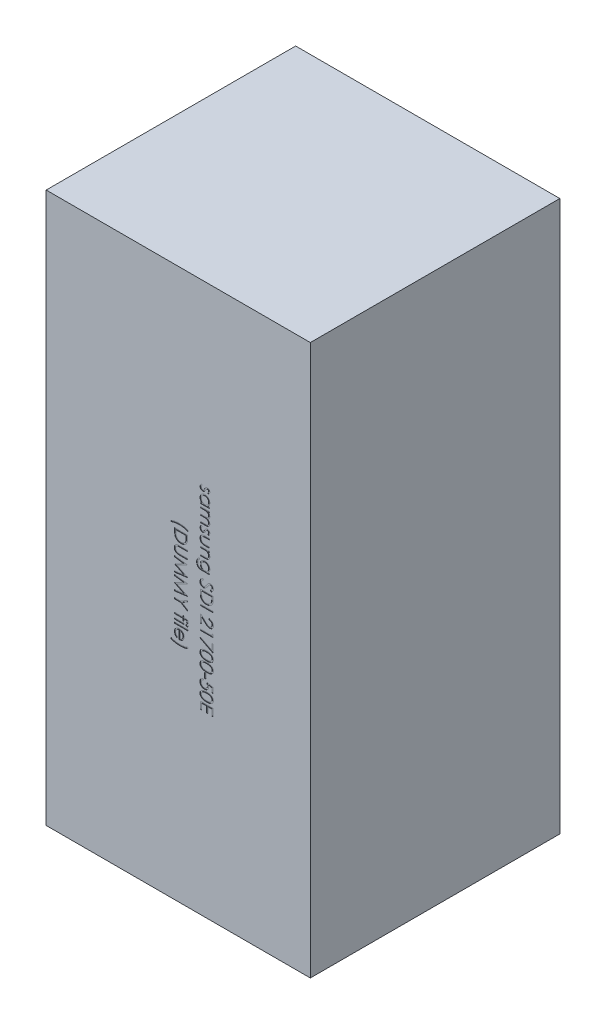
from build123d import *

# Parameters (mm, degrees)
SKETCH_1_W          = 72
SKETCH_1_H          = 150
EXTRUDE_1_DEPTH     = 68
SKETCH_2_W          = 3.5
SKETCH_2_H          = 0.314102564
SKETCH_2_W_2        = 0.358974359
SKETCH_2_H_2        = 1.346153846
SKETCH_2_W_3        = 2.557692308
SKETCH_2_W_4        = 3.58974359
CUT_EXTRUDE_1_DEPTH = 0.1


with BuildPart() as part:
    # 스케치1 → 보스-돌출1 (new body)
    with BuildSketch(Plane.XY):
        Rectangle(SKETCH_1_W, SKETCH_1_H)
    extrude(amount=EXTRUDE_1_DEPTH)

    # 스케치2 → 컷-돌출1 (cut)
    # profile 1 of 31: a face of its own
    with BuildSketch(Plane.XY.offset(68)):
        with BuildLine():
            Line((8.238681891, 25.330128205), (8.019230769, 25.543269231))
            add(Edge.make_bspline(
                [(8.019230769, 25.543269231), (8.040548523, 25.561656717), (8.081646644, 25.597105626), (8.136522231, 25.653377363), (8.182990263, 25.709413124), (8.221225502, 25.764917359), (8.251316988, 25.81999365), (8.272570288, 25.875112242), (8.285913033, 25.930121882), (8.287622239, 25.96691087), (8.288461538, 25.984975962)],
                knots=[0, 0, 0, 0, 1.265880991, 2.440469525, 3.530740057, 4.536711111, 5.468008477, 6.34654737, 7.188078389, 8, 8, 8, 8], degree=3))
            add(Edge.make_bspline(
                [(8.288461538, 25.984975962), (8.287376181, 26.007109166), (8.285240351, 26.050664181), (8.264344046, 26.112985036), (8.231498561, 26.170434889), (8.185841467, 26.220590746), (8.132806978, 26.262848778), (8.074229729, 26.294877994), (8.01054531, 26.313633658), (7.966533213, 26.31607133), (7.944210737, 26.317307692)],
                knots=[0, 0, 0, 0, 1.000196853, 1.968245854, 2.94569445, 3.981000421, 5.021494845, 6.007172807, 6.989258906, 8, 8, 8, 8], degree=3))
            add(Edge.make_bspline(
                [(7.944210737, 26.317307692), (7.923998693, 26.31619688), (7.883631582, 26.313978387), (7.824083548, 26.296731708), (7.76602651, 26.269265635), (7.730463604, 26.243595441), (7.712139423, 26.23036859)],
                knots=[0, 0, 0, 0, 0.960159726, 1.917612774, 2.927026955, 4, 4, 4, 4], degree=3))
            add(Edge.make_bspline(
                [(7.712139423, 26.23036859), (7.702354839, 26.222405096), (7.681529584, 26.205455803), (7.652625731, 26.173647288), (7.62068348, 26.137624785), (7.588746643, 26.094304848), (7.555114918, 26.04555382), (7.521112785, 25.990314535), (7.48414836, 25.930340031), (7.460703924, 25.887402724), (7.448517628, 25.865084135)],
                knots=[0, 0, 0, 0, 0.66740084, 1.420478572, 2.27185888, 3.217733974, 4.268547843, 5.408967954, 6.65319498, 8, 8, 8, 8], degree=3))
            add(Edge.make_bspline(
                [(7.448517628, 25.865084135), (7.433272725, 25.837870558), (7.403824593, 25.785302887), (7.358114889, 25.71061012), (7.312683465, 25.642823079), (7.268016191, 25.581367412), (7.222863324, 25.527425603), (7.178955567, 25.47936105), (7.134966258, 25.438372606), (7.104233145, 25.415418679), (7.089543269, 25.404447115)],
                knots=[0, 0, 0, 0, 1.27191281, 2.456916733, 3.569705269, 4.599008579, 5.553216877, 6.436649441, 7.252746552, 8, 8, 8, 8], degree=3))
            add(Edge.make_bspline(
                [(7.089543269, 25.404447115), (7.059909466, 25.38614531), (7.00100518, 25.349766087), (6.903351967, 25.31305356), (6.800629714, 25.289588218), (6.729999555, 25.286715905), (6.694110577, 25.28525641)],
                knots=[0, 0, 0, 0, 0.995606783, 1.979007074, 2.973082153, 4, 4, 4, 4], degree=3))
            add(Edge.make_bspline(
                [(6.694110577, 25.28525641), (6.668840613, 25.285974293), (6.619043389, 25.287388959), (6.545720292, 25.297270722), (6.475542604, 25.314138588), (6.408099681, 25.337518341), (6.343522979, 25.367499309), (6.282298951, 25.405180523), (6.223907606, 25.448870119), (6.168677169, 25.498311977), (6.118568111, 25.553224855), (6.074973865, 25.612272993), (6.038155825, 25.674567137), (6.007930161, 25.740122482), (5.983851093, 25.80907836), (5.967191533, 25.881491787), (5.957217963, 25.95711996), (5.955833599, 26.008549848), (5.955128205, 26.034755609)],
                knots=[0, 0, 0, 0, 1.032633728, 2.034917567, 3.017159222, 3.977707287, 4.947659047, 5.920662675, 6.910168127, 7.92466491, 8.94557085, 9.942744688, 10.919024275, 11.897637117, 12.88838639, 13.898512555, 14.929200919, 16, 16, 16, 16], degree=3))
            add(Edge.make_bspline(
                [(5.955128205, 26.034755609), (5.956120905, 26.070122784), (5.958092513, 26.140365711), (5.976598574, 26.24425543), (6.005393968, 26.345776189), (6.045109902, 26.444159729), (6.095260615, 26.537205843), (6.155323008, 26.622336768), (6.223313006, 26.69984823), (6.275425916, 26.743966504), (6.301482372, 26.766025641)],
                knots=[0, 0, 0, 0, 1.013940152, 2.01379169, 3.017749504, 4.037548394, 5.051665909, 6.043208538, 7.021604269, 8, 8, 8, 8], degree=3))
            Line((6.301482372, 26.766025641), (6.538461538, 26.557792468))
            add(Edge.make_bspline(
                [(6.538461538, 26.557792468), (6.517106774, 26.538020055), (6.475707334, 26.499688243), (6.420582993, 26.438387026), (6.374381722, 26.376007625), (6.335738307, 26.313172938), (6.305962904, 26.248952844), (6.28504431, 26.18370723), (6.271600118, 26.117568806), (6.270021836, 26.07314667), (6.269230769, 26.05088141)],
                knots=[0, 0, 0, 0, 1.179806542, 2.287233372, 3.337373186, 4.324005949, 5.273901747, 6.200048787, 7.097828587, 8, 8, 8, 8], degree=3))
            add(Edge.make_bspline(
                [(6.269230769, 26.05088141), (6.270601594, 26.020563484), (6.273279956, 25.961327343), (6.297597048, 25.876483584), (6.335727, 25.798144958), (6.389811698, 25.730121612), (6.452767271, 25.672219451), (6.52368139, 25.630291277), (6.600472847, 25.604015101), (6.653705149, 25.600929103), (6.680789263, 25.599358974)],
                knots=[0, 0, 0, 0, 1.072336372, 2.095165389, 3.102688358, 4.141489647, 5.156069229, 6.117746104, 7.042326257, 8, 8, 8, 8], degree=3))
            add(Edge.make_bspline(
                [(6.680789263, 25.599358974), (6.703098881, 25.600445269), (6.747146237, 25.602590011), (6.810896578, 25.619433283), (6.871365859, 25.646046136), (6.906755506, 25.672250784), (6.924779647, 25.685596955)],
                knots=[0, 0, 0, 0, 1.013901739, 2.00181326, 2.98231254, 4, 4, 4, 4], degree=3))
            add(Edge.make_bspline(
                [(6.924779647, 25.685596955), (6.93381501, 25.69361935), (6.953497292, 25.711095022), (6.98192237, 25.743150263), (7.01256047, 25.781532125), (7.044892059, 25.826672288), (7.078490664, 25.87866175), (7.113180016, 25.937711226), (7.150607742, 26.003011778), (7.175427397, 26.04918241), (7.188401442, 26.073317308)],
                knots=[0, 0, 0, 0, 0.615000592, 1.339693406, 2.178160186, 3.116406724, 4.166410947, 5.330106347, 6.604359322, 8, 8, 8, 8], degree=3))
            add(Edge.make_bspline(
                [(7.188401442, 26.073317308), (7.202940574, 26.099363948), (7.23113659, 26.149876695), (7.275052671, 26.221423986), (7.319719945, 26.28597134), (7.362632784, 26.345071915), (7.406053728, 26.397232921), (7.45003098, 26.442248869), (7.492790966, 26.481892085), (7.523088263, 26.503839496), (7.537560096, 26.514322917)],
                knots=[0, 0, 0, 0, 1.262093308, 2.447601706, 3.550203992, 4.582594899, 5.537233252, 6.418365656, 7.244515135, 8, 8, 8, 8], degree=3))
            add(Edge.make_bspline(
                [(7.537560096, 26.514322917), (7.566705711, 26.532453516), (7.625007126, 26.568721052), (7.722317603, 26.603936243), (7.824762661, 26.628142272), (7.895449515, 26.630304662), (7.931590545, 26.631410256)],
                knots=[0, 0, 0, 0, 0.985009483, 1.970363186, 2.962279964, 4, 4, 4, 4], degree=3))
            add(Edge.make_bspline(
                [(7.931590545, 26.631410256), (7.955215889, 26.630875984), (8.001454035, 26.629830336), (8.069393613, 26.621487374), (8.133939, 26.606291689), (8.196075886, 26.587251161), (8.2545413, 26.560715478), (8.310454167, 26.529199558), (8.362769164, 26.491167971), (8.411747706, 26.448419955), (8.456698919, 26.401947999), (8.49524325, 26.351050218), (8.528389265, 26.29754817), (8.556143863, 26.241130106), (8.577148114, 26.181312253), (8.591604713, 26.118497149), (8.601260131, 26.05281619), (8.602123186, 26.007915037), (8.602564103, 25.984975962)],
                knots=[0, 0, 0, 0, 1.087761869, 2.12890409, 3.144425528, 4.138218063, 5.116152125, 6.094559764, 7.089109474, 8.088306095, 9.085414286, 10.060442677, 11.0220762, 11.979848209, 12.949875201, 13.933947973, 14.944496518, 16, 16, 16, 16], degree=3))
            add(Edge.make_bspline(
                [(8.602564103, 25.984975962), (8.601462347, 25.957782564), (8.599238168, 25.902885648), (8.581492152, 25.820551837), (8.552592355, 25.738432577), (8.511740715, 25.656443703), (8.460358873, 25.574235906), (8.39711483, 25.492177673), (8.323793795, 25.408935811), (8.267686429, 25.356984357), (8.238681891, 25.330128205)],
                knots=[0, 0, 0, 0, 0.845753203, 1.707371858, 2.609134499, 3.549244224, 4.552329203, 5.621587647, 6.770486714, 8, 8, 8, 8], degree=3))
        make_face()
    # profile 2 of 31: a face of its own
    with BuildSketch(Plane.XY.offset(68)):
        with BuildLine():
            Line((8.557692308, 22.054487179), (6, 22.054487179))
            Line((6, 22.054487179), (6, 22.368589744))
            Line((6, 22.368589744), (6.442407853, 22.368589744))
            add(Edge.make_bspline(
                [(6.442407853, 22.368589744), (6.402357452, 22.404001128), (6.32419859, 22.47310689), (6.222394827, 22.588506876), (6.137553673, 22.710321993), (6.069666853, 22.838964165), (6.018284474, 22.974048499), (5.982150896, 23.115189767), (5.958628923, 23.262199863), (5.95630558, 23.362455679), (5.955128205, 23.413261218)],
                knots=[0, 0, 0, 0, 1.074295371, 2.096500925, 3.086030275, 4.053105238, 5.014108356, 5.985331429, 6.979048527, 8, 8, 8, 8], degree=3))
            add(Edge.make_bspline(
                [(5.955128205, 23.413261218), (5.956354374, 23.458429295), (5.958772433, 23.547502741), (5.977537663, 23.678530054), (6.007657479, 23.80462882), (6.049598139, 23.925879406), (6.10494392, 24.04146024), (6.171919959, 24.152022588), (6.25089654, 24.257824484), (6.341535176, 24.356853797), (6.439877501, 24.448161278), (6.545073941, 24.528046101), (6.655679624, 24.59575109), (6.771663464, 24.651392465), (6.892940677, 24.694450678), (7.019428064, 24.724407544), (7.150915158, 24.743152552), (7.240455063, 24.745569386), (7.285857372, 24.746794872)],
                knots=[0, 0, 0, 0, 1.034036272, 2.039165313, 3.024406509, 3.999331371, 4.971254918, 5.953351348, 6.95522652, 7.989525907, 9.023492927, 10.024309745, 11.009187477, 11.988246066, 12.964946762, 13.950187958, 14.960617622, 16, 16, 16, 16], degree=3))
            add(Edge.make_bspline(
                [(7.285857372, 24.746794872), (7.330321265, 24.745542206), (7.418223983, 24.743065752), (7.547499942, 24.724608122), (7.672028314, 24.693593396), (7.791347799, 24.649985227), (7.905938937, 24.594314264), (8.014905164, 24.525444902), (8.119913357, 24.445588866), (8.21759609, 24.353305539), (8.307499363, 24.253387402), (8.386667873, 24.146993555), (8.453472192, 24.035450622), (8.507777609, 23.918534946), (8.550931998, 23.797074392), (8.581014763, 23.670146288), (8.598698613, 23.538327854), (8.601263226, 23.448838302), (8.602564103, 23.403445513)],
                knots=[0, 0, 0, 0, 1.02050356, 2.017480486, 2.990790918, 3.96161403, 4.928589988, 5.909588639, 6.91611943, 7.952353252, 8.989586576, 9.99823133, 10.991940466, 11.968822692, 12.952985106, 13.945868367, 14.958059758, 16, 16, 16, 16], degree=3))
            add(Edge.make_bspline(
                [(8.602564103, 23.403445513), (8.601133352, 23.351243622), (8.598327716, 23.248878177), (8.574730898, 23.098955791), (8.5353558, 22.956997631), (8.481240021, 22.822185432), (8.409860859, 22.695042163), (8.319006253, 22.577132619), (8.210751775, 22.46608309), (8.127359309, 22.401719376), (8.084435096, 22.368589744)],
                knots=[0, 0, 0, 0, 1.03879612, 2.037030165, 3.012306674, 3.966139504, 4.922386257, 5.905048148, 6.921675258, 8, 8, 8, 8], degree=3))
            Line((8.084435096, 22.368589744), (8.557692308, 22.368589744))
            Line((8.557692308, 22.368589744), (8.557692308, 22.054487179))
        make_face()
        with BuildLine():
            add(Edge.make_bspline(
                [(8.288461538, 23.399238782), (8.286827918, 23.445153148), (8.283603412, 23.535780802), (8.258429663, 23.668824404), (8.216546024, 23.79613932), (8.159260529, 23.917079746), (8.087245119, 24.02976891), (8.000074446, 24.130385106), (7.900520567, 24.220132103), (7.787746484, 24.294333373), (7.668225935, 24.356892425), (7.542337959, 24.399792402), (7.413575056, 24.42833944), (7.326206752, 24.431237574), (7.282351763, 24.432692308)],
                knots=[0, 0, 0, 0, 1.031093775, 2.03521511, 3.029845951, 4.035119871, 5.034286494, 6.024708811, 7.017619509, 8.03559408, 9.050082311, 10.039808432, 11.016071318, 12, 12, 12, 12], degree=3))
            add(Edge.make_bspline(
                [(7.282351763, 24.432692308), (7.238767492, 24.430810223), (7.151769786, 24.427053432), (7.022624311, 24.400544882), (6.897243126, 24.354614551), (6.776066955, 24.293483416), (6.66306139, 24.217617755), (6.561560746, 24.128615599), (6.474040482, 24.026716362), (6.400785993, 23.913782766), (6.341819613, 23.793347591), (6.300239861, 23.666635949), (6.273984486, 23.535874205), (6.270820672, 23.446803639), (6.269230769, 23.402043269)],
                knots=[0, 0, 0, 0, 0.979154363, 1.954470772, 2.947816011, 3.971783346, 4.997163654, 5.998045606, 6.995988793, 8.00538986, 9.015323546, 10.000094788, 10.994993517, 12, 12, 12, 12], degree=3))
            add(Edge.make_bspline(
                [(6.269230769, 23.402043269), (6.270865873, 23.356591366), (6.274109662, 23.266421952), (6.299704414, 23.133065211), (6.341067285, 23.003450278), (6.399172696, 22.879505215), (6.470855123, 22.764126764), (6.555144025, 22.660704656), (6.652350119, 22.572393854), (6.760039451, 22.498361601), (6.877544377, 22.439879832), (7.003184173, 22.398631883), (7.135971494, 22.373297936), (7.226849293, 22.370180841), (7.273237179, 22.368589744)],
                knots=[0, 0, 0, 0, 1.017484689, 2.018529338, 3.030031036, 4.058138743, 5.076350332, 6.065651025, 7.036469986, 8.00785331, 8.984076697, 9.96571663, 10.961615403, 12, 12, 12, 12], degree=3))
            add(Edge.make_bspline(
                [(7.273237179, 22.368589744), (7.308574996, 22.369549415), (7.378131003, 22.371438352), (7.480258715, 22.385868705), (7.577991728, 22.408824425), (7.671437013, 22.441167708), (7.760062376, 22.483669728), (7.844562515, 22.534877033), (7.924150324, 22.595839961), (7.998725013, 22.664703254), (8.066404356, 22.740930285), (8.126056362, 22.821987852), (8.176538373, 22.907672017), (8.216937187, 22.997922634), (8.249849087, 23.092044585), (8.271586828, 23.190940013), (8.286560777, 23.293612232), (8.28782128, 23.36365922), (8.288461538, 23.399238782)],
                knots=[0, 0, 0, 0, 1.050062701, 2.066855696, 3.059271411, 4.030305351, 4.999747758, 5.975466543, 6.961907836, 7.974539719, 8.98812422, 9.98710676, 10.961662635, 11.93785114, 12.922015094, 13.919620009, 14.94329489, 16, 16, 16, 16], degree=3))
        make_face(mode=Mode.SUBTRACT)
    # profile 3 of 31: a face of its own
    with BuildSketch(Plane.XY.offset(68)):
        with BuildLine():
            Line((8.557692308, 21.336538462), (8.557692308, 21.022435897))
            Line((8.557692308, 21.022435897), (8.11318109, 21.022435897))
            add(Edge.make_bspline(
                [(8.11318109, 21.022435897), (8.152011156, 20.994090597), (8.226287224, 20.939870308), (8.325255602, 20.851812318), (8.407864562, 20.762328758), (8.45179792, 20.698340074), (8.472856571, 20.667668269)],
                knots=[0, 0, 0, 0, 1.134266299, 2.169680534, 3.122669868, 4, 4, 4, 4], degree=3))
            add(Edge.make_bspline(
                [(8.472856571, 20.667668269), (8.492861936, 20.625803607), (8.532523149, 20.542805707), (8.572756708, 20.411386482), (8.597481809, 20.276911813), (8.600863183, 20.186103599), (8.602564103, 20.140424679)],
                knots=[0, 0, 0, 0, 1.014936303, 2.012140481, 3.000054389, 4, 4, 4, 4], degree=3))
            add(Edge.make_bspline(
                [(8.602564103, 20.140424679), (8.601516038, 20.109532808), (8.599441974, 20.048399456), (8.586022434, 19.95779894), (8.562546706, 19.86979089), (8.53067673, 19.784946176), (8.490847572, 19.705493909), (8.445048644, 19.632516053), (8.393315936, 19.566908751), (8.333646317, 19.50877828), (8.264307088, 19.456510503), (8.183443644, 19.408431274), (8.089235738, 19.364006178), (8.020869234, 19.339384852), (7.984875801, 19.326422276)],
                knots=[0, 0, 0, 0, 1.009798505, 1.998336943, 2.985959917, 3.981996858, 4.955664737, 5.886087062, 6.794002107, 7.679958053, 8.601272429, 9.625787331, 10.750030247, 12, 12, 12, 12], degree=3))
            add(Edge.make_bspline(
                [(7.984875801, 19.326422276), (8.00960022, 19.312711024), (8.058254405, 19.285729207), (8.127112671, 19.240423571), (8.191519446, 19.192955769), (8.251525932, 19.142921297), (8.306835442, 19.090496632), (8.357632141, 19.035435515), (8.404129426, 18.978049694), (8.458466809, 18.898262505), (8.515957365, 18.794604269), (8.56645072, 18.663875126), (8.597005381, 18.52761401), (8.600702011, 18.434982353), (8.602564103, 18.388321314)],
                knots=[0, 0, 0, 0, 0.861170869, 1.694663331, 2.509326413, 3.297991968, 4.073691563, 4.829592376, 5.579160782, 6.321830913, 7.768780219, 9.179854006, 10.579417172, 12, 12, 12, 12], degree=3))
            add(Edge.make_bspline(
                [(8.602564103, 18.388321314), (8.600946882, 18.345439851), (8.597781823, 18.261516665), (8.57292835, 18.139339399), (8.530250703, 18.025397594), (8.472017066, 17.919920518), (8.398837883, 17.824760704), (8.311769046, 17.742044395), (8.211426423, 17.672274032), (8.117034434, 17.626695392), (8.033699101, 17.595780128), (7.96269281, 17.576718894), (7.884541257, 17.559879199), (7.799150995, 17.545897953), (7.706220387, 17.535679401), (7.605901511, 17.528108686), (7.498116399, 17.522984612), (7.423750899, 17.52262254), (7.385416667, 17.522435897)],
                knots=[0, 0, 0, 0, 1.209669288, 2.367440248, 3.500751976, 4.631527125, 5.755587489, 6.87532382, 8.007944318, 9.190864318, 9.82315674, 10.514484317, 11.263564316, 12.079023757, 12.955305781, 13.901327259, 14.918167583, 16, 16, 16, 16], degree=3))
            Line((7.385416667, 17.522435897), (6, 17.522435897))
            Line((6, 17.522435897), (6, 17.836538462))
            Line((6, 17.836538462), (7.38681891, 17.836538462))
            add(Edge.make_bspline(
                [(7.38681891, 17.836538462), (7.419539484, 17.836616345), (7.482423451, 17.836766024), (7.572675902, 17.839459655), (7.654944259, 17.84453497), (7.72911635, 17.850469607), (7.795365129, 17.858713421), (7.853557577, 17.869359338), (7.904151297, 17.880637064), (7.960237705, 17.899372875), (8.022105492, 17.929321975), (8.088838935, 17.974934537), (8.146882589, 18.032423155), (8.197571232, 18.098875095), (8.237952899, 18.174718738), (8.267882751, 18.257957964), (8.285575847, 18.348312025), (8.287483451, 18.410911922), (8.288461538, 18.443008814)],
                knots=[0, 0, 0, 0, 1.253542879, 2.409118771, 3.458568974, 4.411070626, 5.259544058, 6.014735414, 6.677123945, 7.243402448, 8.276608576, 9.299873988, 10.325604302, 11.392892819, 12.490509435, 13.603538441, 14.771260462, 16, 16, 16, 16], degree=3))
            add(Edge.make_bspline(
                [(8.288461538, 18.443008814), (8.287014542, 18.482670503), (8.284146413, 18.561284951), (8.255950906, 18.675853024), (8.212385428, 18.785649415), (8.150185446, 18.887722772), (8.075344854, 18.981738616), (7.986403783, 19.062641354), (7.885771538, 19.12947268), (7.792625416, 19.174726871), (7.708955886, 19.203316141), (7.635858535, 19.222193064), (7.552776961, 19.236876453), (7.460269472, 19.250646983), (7.357699291, 19.259634711), (7.24554089, 19.267803083), (7.123456931, 19.271623946), (7.038830242, 19.272158405), (6.994891827, 19.272435897)],
                knots=[0, 0, 0, 0, 1.090512009, 2.161531735, 3.230072964, 4.332825141, 5.440581378, 6.529496625, 7.62916386, 8.757669174, 9.370357692, 10.061947597, 10.834545503, 11.692923569, 12.636967211, 13.669242667, 14.789864225, 16, 16, 16, 16], degree=3))
            Line((6.994891827, 19.272435897), (6, 19.272435897))
            Line((6, 19.272435897), (6, 19.586538462))
            Line((6, 19.586538462), (7.300580929, 19.586538462))
            add(Edge.make_bspline(
                [(7.300580929, 19.586538462), (7.337274664, 19.586614333), (7.40786972, 19.586760303), (7.509097926, 19.589483484), (7.601196973, 19.594416154), (7.68393561, 19.600787099), (7.757538678, 19.607701751), (7.821764733, 19.618644377), (7.876881031, 19.630050975), (7.937915239, 19.647458486), (8.004122588, 19.677609675), (8.075242249, 19.723472871), (8.137919998, 19.780447746), (8.191070408, 19.848140277), (8.234636908, 19.924578639), (8.266511973, 20.008676401), (8.284896886, 20.099902273), (8.287250913, 20.162777035), (8.288461538, 20.195112179)],
                knots=[0, 0, 0, 0, 1.320226356, 2.539982809, 3.643122147, 4.638255983, 5.52602392, 6.301561104, 6.98107216, 7.550523949, 8.58191082, 9.584830316, 10.584890324, 11.614493144, 12.668965657, 13.738783174, 14.837104585, 16, 16, 16, 16], degree=3))
            add(Edge.make_bspline(
                [(8.288461538, 20.195112179), (8.286931078, 20.233128391), (8.283880926, 20.30889335), (8.256426653, 20.420195323), (8.213422576, 20.527680991), (8.153762766, 20.62963575), (8.079863653, 20.723309673), (7.992948884, 20.805318774), (7.89409937, 20.874258152), (7.801936418, 20.920000205), (7.720359678, 20.949476009), (7.651020996, 20.969151594), (7.573931257, 20.985651505), (7.489259139, 20.999637143), (7.396828901, 21.010161136), (7.296901771, 21.016457581), (7.189162142, 21.021992246), (7.114792124, 21.022284386), (7.076221955, 21.022435897)],
                knots=[0, 0, 0, 0, 1.098813768, 2.189896819, 3.297771711, 4.440532809, 5.596253211, 6.739894833, 7.8864334, 9.072265856, 9.705655743, 10.395080422, 11.156654178, 11.986235968, 12.878145268, 13.847797945, 14.883813667, 16, 16, 16, 16], degree=3))
            Line((7.076221955, 21.022435897), (6, 21.022435897))
            Line((6, 21.022435897), (6, 21.336538462))
            Line((6, 21.336538462), (8.557692308, 21.336538462))
        make_face()
    # profile 4 of 31: a face of its own
    with BuildSketch(Plane.XY.offset(68)):
        with BuildLine():
            Line((8.238681891, 15.592948718), (8.019230769, 15.806089744))
            add(Edge.make_bspline(
                [(8.019230769, 15.806089744), (8.040548523, 15.82447723), (8.081646644, 15.859926139), (8.136522231, 15.916197876), (8.182990263, 15.972233636), (8.221225502, 16.027737872), (8.251316988, 16.082814163), (8.272570288, 16.137932755), (8.285913033, 16.192942395), (8.287622239, 16.229731382), (8.288461538, 16.247796474)],
                knots=[0, 0, 0, 0, 1.265880991, 2.440469525, 3.530740057, 4.536711111, 5.468008477, 6.34654737, 7.188078389, 8, 8, 8, 8], degree=3))
            add(Edge.make_bspline(
                [(8.288461538, 16.247796474), (8.287376181, 16.269929679), (8.285240351, 16.313484694), (8.264344046, 16.375805549), (8.231498561, 16.433255401), (8.185841467, 16.483411259), (8.132806978, 16.525669291), (8.074229729, 16.557698507), (8.01054531, 16.576454171), (7.966533213, 16.578891843), (7.944210737, 16.580128205)],
                knots=[0, 0, 0, 0, 1.000196853, 1.968245854, 2.94569445, 3.981000421, 5.021494845, 6.007172807, 6.989258906, 8, 8, 8, 8], degree=3))
            add(Edge.make_bspline(
                [(7.944210737, 16.580128205), (7.923998693, 16.579017393), (7.883631582, 16.5767989), (7.824083548, 16.55955222), (7.76602651, 16.532086148), (7.730463604, 16.506415954), (7.712139423, 16.493189103)],
                knots=[0, 0, 0, 0, 0.960159726, 1.917612774, 2.927026955, 4, 4, 4, 4], degree=3))
            add(Edge.make_bspline(
                [(7.712139423, 16.493189103), (7.702354839, 16.485225609), (7.681529584, 16.468276316), (7.652625731, 16.436467801), (7.62068348, 16.400445298), (7.588746643, 16.35712536), (7.555114918, 16.308374333), (7.521112785, 16.253135048), (7.48414836, 16.193160543), (7.460703924, 16.150223237), (7.448517628, 16.127904647)],
                knots=[0, 0, 0, 0, 0.66740084, 1.420478572, 2.27185888, 3.217733974, 4.268547843, 5.408967954, 6.65319498, 8, 8, 8, 8], degree=3))
            add(Edge.make_bspline(
                [(7.448517628, 16.127904647), (7.433272725, 16.10069107), (7.403824593, 16.0481234), (7.358114889, 15.973430633), (7.312683465, 15.905643592), (7.268016191, 15.844187924), (7.222863324, 15.790246116), (7.178955567, 15.742181563), (7.134966258, 15.701193119), (7.104233145, 15.678239192), (7.089543269, 15.667267628)],
                knots=[0, 0, 0, 0, 1.27191281, 2.456916733, 3.569705269, 4.599008579, 5.553216877, 6.436649441, 7.252746552, 8, 8, 8, 8], degree=3))
            add(Edge.make_bspline(
                [(7.089543269, 15.667267628), (7.059909466, 15.648965823), (7.00100518, 15.6125866), (6.903351967, 15.575874073), (6.800629714, 15.552408731), (6.729999555, 15.549536418), (6.694110577, 15.548076923)],
                knots=[0, 0, 0, 0, 0.995606783, 1.979007074, 2.973082153, 4, 4, 4, 4], degree=3))
            add(Edge.make_bspline(
                [(6.694110577, 15.548076923), (6.668840613, 15.548794806), (6.619043389, 15.550209472), (6.545720292, 15.560091234), (6.475542604, 15.576959101), (6.408099681, 15.600338854), (6.343522979, 15.630319821), (6.282298951, 15.668001036), (6.223907606, 15.711690631), (6.168677169, 15.76113249), (6.118568111, 15.816045367), (6.074973865, 15.875093506), (6.038155825, 15.93738765), (6.007930161, 16.002942995), (5.983851093, 16.071898873), (5.967191533, 16.1443123), (5.957217963, 16.219940472), (5.955833599, 16.271370361), (5.955128205, 16.297576122)],
                knots=[0, 0, 0, 0, 1.032633728, 2.034917567, 3.017159222, 3.977707287, 4.947659047, 5.920662675, 6.910168127, 7.92466491, 8.94557085, 9.942744688, 10.919024275, 11.897637117, 12.88838639, 13.898512555, 14.929200919, 16, 16, 16, 16], degree=3))
            add(Edge.make_bspline(
                [(5.955128205, 16.297576122), (5.956120905, 16.332943297), (5.958092513, 16.403186224), (5.976598574, 16.507075943), (6.005393968, 16.608596702), (6.045109902, 16.706980242), (6.095260615, 16.800026356), (6.155323008, 16.885157281), (6.223313006, 16.962668743), (6.275425916, 17.006787017), (6.301482372, 17.028846154)],
                knots=[0, 0, 0, 0, 1.013940152, 2.01379169, 3.017749504, 4.037548394, 5.051665909, 6.043208538, 7.021604269, 8, 8, 8, 8], degree=3))
            Line((6.301482372, 17.028846154), (6.538461538, 16.820612981))
            add(Edge.make_bspline(
                [(6.538461538, 16.820612981), (6.517106774, 16.800840568), (6.475707334, 16.762508756), (6.420582993, 16.701207539), (6.374381722, 16.638828138), (6.335738307, 16.575993451), (6.305962904, 16.511773357), (6.28504431, 16.446527743), (6.271600118, 16.380389318), (6.270021836, 16.335967183), (6.269230769, 16.313701923)],
                knots=[0, 0, 0, 0, 1.179806542, 2.287233372, 3.337373186, 4.324005949, 5.273901747, 6.200048787, 7.097828587, 8, 8, 8, 8], degree=3))
            add(Edge.make_bspline(
                [(6.269230769, 16.313701923), (6.270601594, 16.283383997), (6.273279956, 16.224147856), (6.297597048, 16.139304097), (6.335727, 16.06096547), (6.389811698, 15.992942125), (6.452767271, 15.935039964), (6.52368139, 15.893111789), (6.600472847, 15.866835614), (6.653705149, 15.863749615), (6.680789263, 15.862179487)],
                knots=[0, 0, 0, 0, 1.072336372, 2.095165389, 3.102688358, 4.141489647, 5.156069229, 6.117746104, 7.042326257, 8, 8, 8, 8], degree=3))
            add(Edge.make_bspline(
                [(6.680789263, 15.862179487), (6.703098881, 15.863265782), (6.747146237, 15.865410524), (6.810896578, 15.882253796), (6.871365859, 15.908866649), (6.906755506, 15.935071297), (6.924779647, 15.948417468)],
                knots=[0, 0, 0, 0, 1.013901739, 2.00181326, 2.98231254, 4, 4, 4, 4], degree=3))
            add(Edge.make_bspline(
                [(6.924779647, 15.948417468), (6.93381501, 15.956439862), (6.953497292, 15.973915535), (6.98192237, 16.005970776), (7.01256047, 16.044352638), (7.044892059, 16.089492801), (7.078490664, 16.141482263), (7.113180016, 16.200531739), (7.150607742, 16.265832291), (7.175427397, 16.312002922), (7.188401442, 16.336137821)],
                knots=[0, 0, 0, 0, 0.615000592, 1.339693406, 2.178160186, 3.116406724, 4.166410947, 5.330106347, 6.604359322, 8, 8, 8, 8], degree=3))
            add(Edge.make_bspline(
                [(7.188401442, 16.336137821), (7.202940574, 16.362184461), (7.23113659, 16.412697208), (7.275052671, 16.484244499), (7.319719945, 16.548791853), (7.362632784, 16.607892428), (7.406053728, 16.660053433), (7.45003098, 16.705069382), (7.492790966, 16.744712598), (7.523088263, 16.766660009), (7.537560096, 16.777143429)],
                knots=[0, 0, 0, 0, 1.262093308, 2.447601706, 3.550203992, 4.582594899, 5.537233252, 6.418365656, 7.244515135, 8, 8, 8, 8], degree=3))
            add(Edge.make_bspline(
                [(7.537560096, 16.777143429), (7.566705711, 16.795274029), (7.625007126, 16.831541564), (7.722317603, 16.866756756), (7.824762661, 16.890962784), (7.895449515, 16.893125175), (7.931590545, 16.894230769)],
                knots=[0, 0, 0, 0, 0.985009483, 1.970363186, 2.962279964, 4, 4, 4, 4], degree=3))
            add(Edge.make_bspline(
                [(7.931590545, 16.894230769), (7.955215889, 16.893696497), (8.001454035, 16.892650849), (8.069393613, 16.884307887), (8.133939, 16.869112202), (8.196075886, 16.850071674), (8.2545413, 16.823535991), (8.310454167, 16.79202007), (8.362769164, 16.753988484), (8.411747706, 16.711240468), (8.456698919, 16.664768512), (8.49524325, 16.613870731), (8.528389265, 16.560368682), (8.556143863, 16.503950619), (8.577148114, 16.444132766), (8.591604713, 16.381317662), (8.601260131, 16.315636703), (8.602123186, 16.27073555), (8.602564103, 16.247796474)],
                knots=[0, 0, 0, 0, 1.087761869, 2.12890409, 3.144425528, 4.138218063, 5.116152125, 6.094559764, 7.089109474, 8.088306095, 9.085414286, 10.060442677, 11.0220762, 11.979848209, 12.949875201, 13.933947973, 14.944496518, 16, 16, 16, 16], degree=3))
            add(Edge.make_bspline(
                [(8.602564103, 16.247796474), (8.601462347, 16.220603076), (8.599238168, 16.165706161), (8.581492152, 16.08337235), (8.552592355, 16.00125309), (8.511740715, 15.919264216), (8.460358873, 15.837056419), (8.39711483, 15.754998186), (8.323793795, 15.671756324), (8.267686429, 15.61980487), (8.238681891, 15.592948718)],
                knots=[0, 0, 0, 0, 0.845753203, 1.707371858, 2.609134499, 3.549244224, 4.552329203, 5.621587647, 6.770486714, 8, 8, 8, 8], degree=3))
        make_face()
    # profile 5 of 31: a face of its own
    with BuildSketch(Plane.XY.offset(68)):
        with BuildLine():
            Line((8.557692308, 14.96474359), (8.557692308, 14.650641026))
            Line((8.557692308, 14.650641026), (7.371394231, 14.650641026))
            add(Edge.make_bspline(
                [(7.371394231, 14.650641026), (7.336571482, 14.650499121), (7.269957194, 14.650227663), (7.174102007, 14.648386722), (7.086685294, 14.644056629), (7.007656557, 14.638642804), (6.937029166, 14.631680668), (6.875049809, 14.623397308), (6.821015625, 14.614138886), (6.788472269, 14.605076172), (6.77333734, 14.600861378)],
                knots=[0, 0, 0, 0, 1.388932606, 2.656963016, 3.823490214, 4.879454478, 5.816252168, 6.653371382, 7.373723809, 8, 8, 8, 8], degree=3))
            add(Edge.make_bspline(
                [(6.77333734, 14.600861378), (6.754314522, 14.594099879), (6.716664366, 14.58071745), (6.66227459, 14.556444611), (6.611902173, 14.526413876), (6.563587464, 14.493562952), (6.518825676, 14.455629891), (6.477324454, 14.413169342), (6.438599671, 14.366934971), (6.391894487, 14.299210771), (6.342467449, 14.20663095), (6.299224971, 14.085354293), (6.273761575, 13.953616775), (6.270768951, 13.862459171), (6.269230769, 13.815604968)],
                knots=[0, 0, 0, 0, 0.725930277, 1.436768641, 2.137297926, 2.832005607, 3.535753883, 4.242956221, 4.964984144, 5.701683124, 7.198126434, 8.723945959, 10.316137162, 12, 12, 12, 12], degree=3))
            add(Edge.make_bspline(
                [(6.269230769, 13.815604968), (6.270763206, 13.768744827), (6.273720675, 13.678308864), (6.298840522, 13.547947811), (6.339821483, 13.428562692), (6.397828501, 13.321547438), (6.468546589, 13.227573846), (6.551561506, 13.149271402), (6.644209328, 13.084663642), (6.713333816, 13.056454289), (6.748096955, 13.042267628)],
                knots=[0, 0, 0, 0, 1.157091467, 2.233085092, 3.266839029, 4.264239195, 5.228693433, 6.160074799, 7.074690074, 8, 8, 8, 8], degree=3))
            add(Edge.make_bspline(
                [(6.748096955, 13.042267628), (6.762062957, 13.038070296), (6.792938376, 13.028791018), (6.84532423, 13.018892501), (6.907735501, 13.009606689), (6.980827619, 13.003415931), (7.06395603, 12.996350373), (7.157550626, 12.993910617), (7.261059725, 12.99042652), (7.333529294, 12.990398996), (7.371394231, 12.990384615)],
                knots=[0, 0, 0, 0, 0.557560243, 1.232629526, 2.036798082, 2.970922211, 4.03790722, 5.227863888, 6.551574656, 8, 8, 8, 8], degree=3))
            Line((7.371394231, 12.990384615), (8.557692308, 12.990384615))
            Line((8.557692308, 12.990384615), (8.557692308, 12.676282051))
            Line((8.557692308, 12.676282051), (7.3125, 12.676282051))
            add(Edge.make_bspline(
                [(7.3125, 12.676282051), (7.270192828, 12.676723745), (7.188111126, 12.677580691), (7.068827026, 12.683088049), (6.957664743, 12.692537612), (6.854565649, 12.706880465), (6.759607746, 12.723745576), (6.672671696, 12.745503715), (6.594017487, 12.771475729), (6.522291359, 12.800802166), (6.457190155, 12.835351423), (6.395768795, 12.872370704), (6.338129531, 12.913917229), (6.283989051, 12.959623039), (6.233543731, 13.009282854), (6.187013486, 13.063228448), (6.143574873, 13.120377761), (6.104077801, 13.181727095), (6.068870026, 13.247339103), (6.038173414, 13.316883669), (6.012814759, 13.390868099), (5.992079425, 13.468463607), (5.974909687, 13.550319535), (5.963400657, 13.636082933), (5.956074478, 13.725966109), (5.955448926, 13.787077577), (5.955128205, 13.818409455)],
                knots=[0, 0, 0, 0, 1.492959813, 2.896546261, 4.212934643, 5.4282803, 6.568701279, 7.614836728, 8.587629399, 9.489753423, 10.345563548, 11.185732697, 12.018869657, 12.849922188, 13.68387515, 14.5140269, 15.361852057, 16.215154979, 17.085973896, 17.987004002, 18.894652782, 19.842944701, 20.819888734, 21.843945232, 22.894589698, 24, 24, 24, 24], degree=3))
            add(Edge.make_bspline(
                [(5.955128205, 13.818409455), (5.955467912, 13.849505969), (5.956135468, 13.910613514), (5.963277276, 14.000284759), (5.975085447, 14.086233365), (5.991940664, 14.168153763), (6.012979734, 14.246128161), (6.03798327, 14.320472401), (6.069063751, 14.390315964), (6.104041309, 14.456497968), (6.143606584, 14.518500356), (6.186974624, 14.576608934), (6.234080687, 14.630745786), (6.284728044, 14.680922854), (6.33954498, 14.726435831), (6.398090541, 14.767851873), (6.459784629, 14.805808578), (6.525847792, 14.840161368), (6.598419802, 14.869673124), (6.678716899, 14.89572837), (6.767619415, 14.917039008), (6.865051344, 14.934381476), (6.970546385, 14.948332917), (7.084714801, 14.958019059), (7.207278493, 14.96343489), (7.291928383, 14.964297951), (7.335637019, 14.96474359)],
                knots=[0, 0, 0, 0, 1.083640291, 2.129454052, 3.13281866, 4.105697902, 5.042300162, 5.946461698, 6.836384745, 7.703652036, 8.553297018, 9.397182691, 10.228592656, 11.052265423, 11.879314572, 12.708807002, 13.549817954, 14.402308542, 15.300838682, 16.27712199, 17.341985831, 18.484375296, 19.725102775, 21.0496083, 22.476576903, 24, 24, 24, 24], degree=3))
            Line((7.335637019, 14.96474359), (8.557692308, 14.96474359))
        make_face()
    # profile 6 of 31: a face of its own
    with BuildSketch(Plane.XY.offset(68)):
        with BuildLine():
            Line((8.557692308, 11.958333333), (8.557692308, 11.644230769))
            Line((8.557692308, 11.644230769), (8.096354167, 11.644230769))
            add(Edge.make_bspline(
                [(8.096354167, 11.644230769), (8.13819689, 11.610693134), (8.219394153, 11.545612183), (8.326114728, 11.43722785), (8.414059953, 11.322683949), (8.484163747, 11.202681946), (8.537010373, 11.077058936), (8.575176304, 10.946580666), (8.598061132, 10.81046596), (8.601051363, 10.717901523), (8.602564103, 10.671073718)],
                knots=[0, 0, 0, 0, 1.12780773, 2.188550248, 3.19190651, 4.159438251, 5.104880172, 6.052711206, 7.014878035, 8, 8, 8, 8], degree=3))
            add(Edge.make_bspline(
                [(8.602564103, 10.671073718), (8.600816311, 10.623744363), (8.59739546, 10.531109398), (8.570415368, 10.396213309), (8.524064243, 10.270112657), (8.461213167, 10.153083682), (8.382632941, 10.047815681), (8.290595286, 9.956203943), (8.185541158, 9.879786053), (8.087781304, 9.828626369), (8.001097779, 9.794895311), (7.926849794, 9.773664241), (7.844132021, 9.755632872), (7.753192316, 9.740001243), (7.653394161, 9.729424095), (7.545146458, 9.721081814), (7.428484331, 9.715103117), (7.347797703, 9.71486591), (7.306189904, 9.71474359)],
                knots=[0, 0, 0, 0, 1.235764744, 2.418689688, 3.575570385, 4.733739044, 5.876600945, 6.994686206, 8.113221397, 9.257403329, 9.866223892, 10.540462211, 11.272173464, 12.077110251, 12.949508505, 13.892531187, 14.913238277, 16, 16, 16, 16], degree=3))
            Line((7.306189904, 9.71474359), (6, 9.71474359))
            Line((6, 9.71474359), (6, 10.028846154))
            Line((6, 10.028846154), (7.203125, 10.028846154))
            add(Edge.make_bspline(
                [(7.203125, 10.028846154), (7.237947445, 10.029039362), (7.304556856, 10.029408936), (7.399925879, 10.030574583), (7.486412457, 10.033384389), (7.563809825, 10.037332702), (7.632043661, 10.043111733), (7.691252938, 10.049134364), (7.74136248, 10.056499341), (7.771527563, 10.063062254), (7.78505609, 10.066005609)],
                knots=[0, 0, 0, 0, 1.430800155, 2.736877192, 3.918605307, 4.986035426, 5.920637409, 6.731861385, 7.431261377, 8, 8, 8, 8], degree=3))
            add(Edge.make_bspline(
                [(7.78505609, 10.066005609), (7.824767275, 10.07663114), (7.901199019, 10.097082001), (8.004873372, 10.147615984), (8.09307156, 10.211430165), (8.165248281, 10.289328014), (8.221419118, 10.38055709), (8.260393073, 10.484864233), (8.284769342, 10.601242874), (8.287196474, 10.683097256), (8.288461538, 10.725761218)],
                knots=[0, 0, 0, 0, 1.084156227, 2.086665306, 3.027808233, 3.945421172, 4.874247719, 5.839848303, 6.874090471, 8, 8, 8, 8], degree=3))
            add(Edge.make_bspline(
                [(8.288461538, 10.725761218), (8.287985711, 10.75102899), (8.287044061, 10.801033258), (8.277590178, 10.87518194), (8.2621414, 10.947110944), (8.241237083, 11.017513342), (8.212790713, 11.084895712), (8.179863653, 11.151227145), (8.139543314, 11.214609355), (8.094363823, 11.27624112), (8.044012468, 11.333512445), (7.991660258, 11.387565402), (7.935103152, 11.43505676), (7.876343885, 11.47816587), (7.814201298, 11.515333449), (7.749339871, 11.547789399), (7.681656952, 11.575324328), (7.634681994, 11.589007124), (7.611177885, 11.595853365)],
                knots=[0, 0, 0, 0, 1.02388931, 2.02625049, 3.024079426, 4.004119353, 4.998163158, 5.985366248, 7.002659681, 8.039138713, 9.080111048, 10.09169763, 11.086418407, 12.069932368, 13.043171485, 14.017654831, 15.008125612, 16, 16, 16, 16], degree=3))
            add(Edge.make_bspline(
                [(7.611177885, 11.595853365), (7.593922682, 11.599793014), (7.556359007, 11.608369423), (7.494714588, 11.617632603), (7.423404613, 11.626040178), (7.342512296, 11.633077137), (7.251754421, 11.637382553), (7.151518583, 11.64207695), (7.041405094, 11.643786011), (6.964743402, 11.644078365), (6.924779647, 11.644230769)],
                knots=[0, 0, 0, 0, 0.615963638, 1.340920617, 2.168419149, 3.115676021, 4.16674242, 5.331190069, 6.6087489, 8, 8, 8, 8], degree=3))
            Line((6.924779647, 11.644230769), (6, 11.644230769))
            Line((6, 11.644230769), (6, 11.958333333))
            Line((6, 11.958333333), (8.557692308, 11.958333333))
        make_face()
    # profile 7 of 31: a face of its own
    with BuildSketch(Plane.XY.offset(68)):
        with BuildLine():
            Line((8.557692308, 6.753205128), (8.557692308, 6.439102564))
            Line((8.557692308, 6.439102564), (6.527944712, 6.439102564))
            add(Edge.make_bspline(
                [(6.527944712, 6.439102564), (6.484707117, 6.439379607), (6.401248144, 6.439914366), (6.280569865, 6.443765337), (6.169103779, 6.451886014), (6.06634152, 6.461094695), (5.97275941, 6.474341412), (5.888078206, 6.490517779), (5.812216643, 6.508753458), (5.765491802, 6.524773676), (5.743389423, 6.532351763)],
                knots=[0, 0, 0, 0, 1.307562039, 2.523909702, 3.650326591, 4.686913197, 5.643429486, 6.506965704, 7.293745905, 8, 8, 8, 8], degree=3))
            add(Edge.make_bspline(
                [(5.743389423, 6.532351763), (5.714658501, 6.543539918), (5.658055694, 6.56558171), (5.57783573, 6.606882898), (5.502236129, 6.653059151), (5.432120714, 6.705985404), (5.366386321, 6.764322696), (5.306180809, 6.829142264), (5.250569786, 6.899291561), (5.200653499, 6.975341455), (5.156913632, 7.056521515), (5.118199005, 7.141752054), (5.08476255, 7.230786681), (5.059665852, 7.324481795), (5.037934986, 7.421414186), (5.023789223, 7.522711014), (5.014162463, 7.627783978), (5.013272189, 7.699229335), (5.012820513, 7.735476763)],
                knots=[0, 0, 0, 0, 0.981884813, 1.934411902, 2.870642727, 3.801527012, 4.729816098, 5.667674509, 6.616731011, 7.579249157, 8.562291171, 9.552107921, 10.560574871, 11.588648803, 12.640348669, 13.724070705, 14.845319185, 16, 16, 16, 16], degree=3))
            add(Edge.make_bspline(
                [(5.012820513, 7.735476763), (5.0136751, 7.788362023), (5.015344339, 7.891661145), (5.034861724, 8.042258808), (5.06227927, 8.185100248), (5.104214713, 8.318377807), (5.155320026, 8.441576432), (5.213527987, 8.554143268), (5.280944291, 8.654226906), (5.357416405, 8.744365773), (5.448388025, 8.825703129), (5.555584472, 8.902231698), (5.680652094, 8.975892249), (5.772444699, 9.019060944), (5.820512821, 9.041666667)],
                knots=[0, 0, 0, 0, 1.157931887, 2.261752077, 3.322178827, 4.340878186, 5.316509817, 6.24181319, 7.112369066, 7.954886437, 8.824930176, 9.778504873, 10.836691706, 12, 12, 12, 12], degree=3))
            Line((5.820512821, 9.041666667), (5.820512821, 8.727564103))
            add(Edge.make_bspline(
                [(5.820512821, 8.727564103), (5.780406945, 8.702301893), (5.702004896, 8.652917385), (5.60049174, 8.560568904), (5.513738376, 8.459362578), (5.443827602, 8.345882894), (5.39111781, 8.219657679), (5.353542514, 8.080610993), (5.331046247, 7.927611371), (5.328334953, 7.821093157), (5.326923077, 7.765625)],
                knots=[0, 0, 0, 0, 0.997731894, 1.950442991, 2.880492273, 3.800895997, 4.748200782, 5.754801363, 6.83083817, 8, 8, 8, 8], degree=3))
            add(Edge.make_bspline(
                [(5.326923077, 7.765625), (5.328346724, 7.710856683), (5.331091373, 7.605268851), (5.35365364, 7.453233245), (5.391023453, 7.314362297), (5.443539756, 7.189699077), (5.508401054, 7.081126816), (5.580162299, 6.987205427), (5.661371604, 6.911077731), (5.736146931, 6.859860877), (5.80277195, 6.828026793), (5.860124341, 6.807754433), (5.924977282, 6.791280502), (5.997112999, 6.777500653), (6.076634662, 6.766129743), (6.163724063, 6.758926859), (6.258183286, 6.753721048), (6.323676424, 6.753381078), (6.357572115, 6.753205128)],
                knots=[0, 0, 0, 0, 1.570672572, 3.028099501, 4.397683431, 5.686589315, 6.895122698, 8.017723291, 9.066023084, 10.075791025, 10.603605416, 11.180458235, 11.81795017, 12.521450677, 13.286658401, 14.121327423, 15.027701111, 16, 16, 16, 16], degree=3))
            Line((6.357572115, 6.753205128), (6.490084135, 6.753205128))
            add(Edge.make_bspline(
                [(6.490084135, 6.753205128), (6.452142332, 6.785086246), (6.376926113, 6.848287701), (6.278364476, 6.957435028), (6.193478346, 7.076651944), (6.123859711, 7.205735486), (6.068178287, 7.341523729), (6.029235326, 7.482545959), (6.004075426, 7.627538014), (6.00136811, 7.725790164), (6, 7.775440705)],
                knots=[0, 0, 0, 0, 1.012485704, 2.007162095, 2.997754123, 3.998611389, 4.999708251, 5.992315798, 6.98544096, 8, 8, 8, 8], degree=3))
            add(Edge.make_bspline(
                [(6, 7.775440705), (6.000515026, 7.804676975), (6.001538985, 7.862803532), (6.010497762, 7.949158279), (6.023496504, 8.034238718), (6.042577943, 8.117846421), (6.06706967, 8.200102035), (6.09768641, 8.280869625), (6.132301523, 8.36080316), (6.173074345, 8.438449626), (6.218436581, 8.513035874), (6.267575731, 8.583998633), (6.320233071, 8.65096873), (6.376933506, 8.713299477), (6.437574176, 8.770943283), (6.501585649, 8.824548415), (6.569471468, 8.873630261), (6.641258055, 8.917552708), (6.715195171, 8.957680215), (6.791636971, 8.992036638), (6.870099853, 9.020556888), (6.949602913, 9.045691997), (7.03159592, 9.063490759), (7.115107085, 9.077100733), (7.200645896, 9.084736807), (7.258266105, 9.085935367), (7.287259615, 9.086538462)],
                knots=[0, 0, 0, 0, 1.028796061, 2.045417375, 3.052978994, 4.056772505, 5.061374657, 6.071351207, 7.095367434, 8.125609542, 9.155490328, 10.16637099, 11.162041966, 12.151987513, 13.129482149, 14.104793677, 15.088808581, 16.075021637, 17.065069715, 18.0481558, 19.021557435, 20.00254184, 20.980451754, 21.971763498, 22.979425854, 24, 24, 24, 24], degree=3))
            add(Edge.make_bspline(
                [(7.287259615, 9.086538462), (7.31626285, 9.086019659), (7.374156986, 9.084984062), (7.46003431, 9.07602769), (7.54477144, 9.06327963), (7.627448989, 9.042997061), (7.709260527, 9.018930402), (7.788874113, 8.987716937), (7.867343356, 8.951755044), (7.94398013, 8.910652315), (8.018079371, 8.86464221), (8.088123447, 8.813997485), (8.154694979, 8.759776867), (8.216940122, 8.700889186), (8.275325427, 8.637682535), (8.329338558, 8.569973181), (8.379955814, 8.498514221), (8.42606627, 8.423060901), (8.466848753, 8.3447838), (8.504061288, 8.265669907), (8.533595424, 8.184671691), (8.559618519, 8.103299147), (8.578053715, 8.020119233), (8.592275956, 7.936151839), (8.600940678, 7.851109502), (8.602022263, 7.794156607), (8.602564103, 7.765625)],
                knots=[0, 0, 0, 0, 1.008914434, 2.013921196, 3.001938835, 3.98818112, 4.973517748, 5.967241793, 6.960633033, 7.975722852, 8.991170928, 9.993245185, 10.981396684, 11.976616977, 12.972235889, 13.973022409, 14.988340224, 16.01763096, 17.047082309, 18.058647952, 19.057085865, 20.044802253, 21.029198803, 22.0185208, 23.007341325, 24, 24, 24, 24], degree=3))
            add(Edge.make_bspline(
                [(8.602564103, 7.765625), (8.601228569, 7.718570263), (8.598597863, 7.625882847), (8.577315355, 7.489207951), (8.544144221, 7.357180179), (8.495923726, 7.229123195), (8.43066807, 7.10425535), (8.343609167, 6.983328151), (8.236466658, 6.864271409), (8.153476886, 6.791169963), (8.110376603, 6.753205128)],
                knots=[0, 0, 0, 0, 0.967343326, 1.905452219, 2.838102277, 3.762990896, 4.713322225, 5.726933809, 6.819495538, 8, 8, 8, 8], degree=3))
            Line((8.110376603, 6.753205128), (8.557692308, 6.753205128))
        make_face()
        with BuildLine():
            add(Edge.make_bspline(
                [(8.288461538, 7.740384615), (8.286900487, 7.786315339), (8.283809935, 7.877248432), (8.257425021, 8.010536489), (8.216079879, 8.139214497), (8.15693439, 8.260815854), (8.084850765, 8.374738001), (7.997471728, 8.475757919), (7.897967678, 8.564281116), (7.786294145, 8.638236183), (7.666365493, 8.697660571), (7.540115894, 8.740863662), (7.409000032, 8.767858737), (7.319639175, 8.770902925), (7.274639423, 8.772435897)],
                knots=[0, 0, 0, 0, 1.026331696, 2.03191913, 3.02692423, 4.041490544, 5.047661868, 6.033509946, 7.018359977, 8.017132933, 9.01989117, 10.003339456, 10.994534818, 12, 12, 12, 12], degree=3))
            add(Edge.make_bspline(
                [(7.274639423, 8.772435897), (7.240705946, 8.771710472), (7.173968721, 8.770283772), (7.076033737, 8.756555473), (6.982742814, 8.734391712), (6.894152687, 8.702892486), (6.809414589, 8.664118547), (6.730095282, 8.614176356), (6.654739408, 8.556697979), (6.584895643, 8.490767027), (6.521188158, 8.418228305), (6.465502323, 8.339599718), (6.419331809, 8.255311887), (6.380020229, 8.166711624), (6.351100864, 8.071923148), (6.329073383, 7.972367815), (6.316461499, 7.867377847), (6.314899135, 7.795805868), (6.314102564, 7.759314904)],
                knots=[0, 0, 0, 0, 1.039892369, 2.045164194, 3.025377528, 3.974939947, 4.923826224, 5.876304068, 6.842270891, 7.825700405, 8.815919897, 9.798017152, 10.773083594, 11.758208475, 12.764450271, 13.80592145, 14.881349344, 16, 16, 16, 16], degree=3))
            add(Edge.make_bspline(
                [(6.314102564, 7.759314904), (6.314870173, 7.722351145), (6.316371224, 7.650068908), (6.329274724, 7.544497974), (6.350096696, 7.444465223), (6.379659737, 7.350062438), (6.41738143, 7.260932963), (6.465118259, 7.17807884), (6.519481905, 7.09972056), (6.58289686, 7.028371003), (6.652770925, 6.963821368), (6.72885609, 6.907684444), (6.809684, 6.85947172), (6.896285169, 6.821099268), (6.987515222, 6.789446514), (7.084912477, 6.769491371), (7.187043424, 6.755179499), (7.257057318, 6.753873256), (7.29286859, 6.753205128)],
                knots=[0, 0, 0, 0, 1.121992135, 2.194043731, 3.223932285, 4.220423016, 5.193184374, 6.156086365, 7.118779155, 8.084057622, 9.048292205, 10.002025119, 10.950065319, 11.899697616, 12.87359713, 13.875731462, 14.913461982, 16, 16, 16, 16], degree=3))
            add(Edge.make_bspline(
                [(7.29286859, 6.753205128), (7.339486444, 6.754544696), (7.430561351, 6.757161741), (7.563268109, 6.781858902), (7.68803682, 6.821679101), (7.80447266, 6.877525895), (7.91134271, 6.947507748), (8.006664706, 7.031799174), (8.09057255, 7.128943021), (8.160443783, 7.238673546), (8.217106339, 7.356889577), (8.259055984, 7.480534618), (8.283371668, 7.609259989), (8.28675216, 7.696347822), (8.288461538, 7.740384615)],
                knots=[0, 0, 0, 0, 1.070930318, 2.092221514, 3.091405799, 4.074392322, 5.052047932, 6.019043127, 6.99061078, 7.993717296, 9.000730765, 9.998165278, 10.987753177, 12, 12, 12, 12], degree=3))
        make_face(mode=Mode.SUBTRACT)
    # profile 8 of 31: a face of its own
    with BuildSketch(Plane.XY.offset(68)):
        with BuildLine():
            Line((6.675180288, 4.644230769), (6.852564103, 4.348357372))
            add(Edge.make_bspline(
                [(6.852564103, 4.348357372), (6.806499718, 4.320839135), (6.718242134, 4.268115254), (6.598984093, 4.180163895), (6.497621937, 4.089030984), (6.414745329, 3.99404165), (6.349496442, 3.895775702), (6.303294211, 3.793591648), (6.274478235, 3.687833837), (6.270978149, 3.615860016), (6.269230769, 3.579927885)],
                knots=[0, 0, 0, 0, 1.272034388, 2.437168799, 3.508375237, 4.49857839, 5.41946034, 6.295179144, 7.148887113, 8, 8, 8, 8], degree=3))
            add(Edge.make_bspline(
                [(6.269230769, 3.579927885), (6.270085441, 3.549241021), (6.271779829, 3.488404242), (6.288060647, 3.398842045), (6.313072716, 3.311860068), (6.348893869, 3.229252085), (6.392231555, 3.152154104), (6.444580544, 3.084555728), (6.503176771, 3.026080092), (6.568595717, 2.978378347), (6.63870863, 2.941347173), (6.711319991, 2.914550391), (6.786110405, 2.897495851), (6.836816049, 2.89532515), (6.862379808, 2.894230769)],
                knots=[0, 0, 0, 0, 1.095270387, 2.171376115, 3.241375676, 4.322296363, 5.380636668, 6.392615365, 7.366724986, 8.328592944, 9.273498763, 10.190095884, 11.087518669, 12, 12, 12, 12], degree=3))
            add(Edge.make_bspline(
                [(6.862379808, 2.894230769), (6.891520657, 2.89570508), (6.950759747, 2.898702138), (7.0381594, 2.924033618), (7.12465197, 2.963882865), (7.178153235, 3.000645509), (7.205929487, 3.019731571)],
                knots=[0, 0, 0, 0, 0.938893495, 1.908633276, 2.914225137, 4, 4, 4, 4], degree=3))
            add(Edge.make_bspline(
                [(7.205929487, 3.019731571), (7.226017291, 3.035357822), (7.268312913, 3.068259477), (7.330218384, 3.125606165), (7.395634226, 3.191147886), (7.464294802, 3.265212302), (7.534946198, 3.34927166), (7.609061151, 3.441599902), (7.686416915, 3.542674974), (7.737571527, 3.613908117), (7.764022436, 3.650741186)],
                knots=[0, 0, 0, 0, 0.72226686, 1.520759855, 2.393439377, 3.351307446, 4.386958158, 5.510256019, 6.712608938, 8, 8, 8, 8], degree=3))
            add(Edge.make_bspline(
                [(7.764022436, 3.650741186), (7.790257027, 3.68756027), (7.840415567, 3.757955555), (7.914762239, 3.856477639), (7.983169392, 3.944459949), (8.044684139, 4.022350799), (8.101989442, 4.088135053), (8.152014057, 4.1442176), (8.197429242, 4.188529343), (8.226867212, 4.213187783), (8.240084135, 4.224258814)],
                knots=[0, 0, 0, 0, 1.452255772, 2.776602448, 3.96446981, 5.032613149, 5.964194703, 6.766668629, 7.446264616, 8, 8, 8, 8], degree=3))
            add(Edge.make_bspline(
                [(8.240084135, 4.224258814), (8.260685171, 4.239731359), (8.301199875, 4.270160196), (8.364524733, 4.310326202), (8.429347998, 4.344465364), (8.495843863, 4.371227696), (8.563078792, 4.393763915), (8.631930038, 4.408921846), (8.702088656, 4.418413243), (8.749302157, 4.419385229), (8.772936699, 4.419871795)],
                knots=[0, 0, 0, 0, 1.068054152, 2.10047183, 3.106115577, 4.101338837, 5.06977816, 6.043150881, 7.020423561, 8, 8, 8, 8], degree=3))
            add(Edge.make_bspline(
                [(8.772936699, 4.419871795), (8.809969574, 4.418572279), (8.883243772, 4.416001025), (8.990229619, 4.394077903), (9.092684247, 4.359879283), (9.188350891, 4.310418064), (9.277005834, 4.249265685), (9.357294574, 4.176993178), (9.425365503, 4.091185484), (9.484150669, 3.996512901), (9.530564015, 3.893555204), (9.565761611, 3.785861221), (9.585439222, 3.67295871), (9.588294703, 3.596359073), (9.58974359, 3.557491987)],
                knots=[0, 0, 0, 0, 1.005541892, 1.989591032, 2.955705311, 3.932863626, 4.905387107, 5.876519979, 6.856563935, 7.871847665, 8.897921447, 9.918317993, 10.943742853, 12, 12, 12, 12], degree=3))
            add(Edge.make_bspline(
                [(9.58974359, 3.557491987), (9.588347686, 3.516241739), (9.585579443, 3.434437564), (9.560648427, 3.313881517), (9.520376942, 3.197587746), (9.47399396, 3.103976958), (9.427876069, 3.030839832), (9.385853249, 2.975068066), (9.33747903, 2.918550328), (9.282619521, 2.860832358), (9.220772848, 2.802891673), (9.152362136, 2.743868229), (9.077805587, 2.683623958), (9.024581085, 2.644868098), (8.997295673, 2.625)],
                knots=[0, 0, 0, 0, 1.286821612, 2.551921131, 3.825787379, 5.12137259, 5.803616487, 6.523126609, 7.299589446, 8.125436757, 9.008162487, 9.944516264, 10.946261234, 12, 12, 12, 12], degree=3))
            Line((8.997295673, 2.625), (8.782051282, 2.908954327))
            add(Edge.make_bspline(
                [(8.782051282, 2.908954327), (8.804139973, 2.926100259), (8.846677627, 2.959119316), (8.906248935, 3.009248805), (8.960665442, 3.056497444), (9.007930479, 3.103047873), (9.050632911, 3.14644141), (9.087191686, 3.188558765), (9.11797047, 3.228792101), (9.150800721, 3.279513249), (9.183551326, 3.343398811), (9.210674418, 3.423514564), (9.227560433, 3.507009649), (9.229687874, 3.563721838), (9.230769231, 3.592548077)],
                knots=[0, 0, 0, 0, 1.181667846, 2.275615987, 3.290305621, 4.226321945, 5.078535498, 5.862783384, 6.581873284, 7.217493746, 8.414623899, 9.604724551, 10.782505457, 12, 12, 12, 12], degree=3))
            add(Edge.make_bspline(
                [(9.230769231, 3.592548077), (9.229557531, 3.628704599), (9.227220882, 3.698429047), (9.201700896, 3.797419283), (9.161519036, 3.886513208), (9.105204058, 3.963065773), (9.038483065, 4.02680275), (8.96170421, 4.072908209), (8.876921808, 4.100658373), (8.817780151, 4.104044653), (8.787660256, 4.105769231)],
                knots=[0, 0, 0, 0, 1.14458467, 2.207223713, 3.21896685, 4.227309161, 5.202851033, 6.127160689, 7.046193047, 8, 8, 8, 8], degree=3))
            add(Edge.make_bspline(
                [(8.787660256, 4.105769231), (8.768913559, 4.105357803), (8.731389509, 4.104534274), (8.675804871, 4.0938234), (8.620713639, 4.078635704), (8.565870844, 4.056407574), (8.509986268, 4.026467282), (8.453210792, 3.985757486), (8.394110972, 3.934827854), (8.355710822, 3.895738279), (8.335436699, 3.87510016)],
                knots=[0, 0, 0, 0, 0.858526328, 1.718456515, 2.587092892, 3.476767204, 4.426280253, 5.487868114, 6.673670035, 8, 8, 8, 8], degree=3))
            add(Edge.make_bspline(
                [(8.335436699, 3.87510016), (8.328599673, 3.867438788), (8.312356465, 3.849237121), (8.285764184, 3.815961195), (8.252961412, 3.772018397), (8.212374095, 3.718556196), (8.165292633, 3.654588834), (8.112319021, 3.580109278), (8.051733562, 3.495947745), (8.009376021, 3.436225829), (7.986979167, 3.404647436)],
                knots=[0, 0, 0, 0, 0.420754252, 0.999615792, 1.744751191, 2.668019286, 3.750313428, 4.999500688, 6.413464383, 8, 8, 8, 8], degree=3))
            add(Edge.make_bspline(
                [(7.986979167, 3.404647436), (7.959337807, 3.366661523), (7.905814145, 3.293107066), (7.825398465, 3.188449486), (7.746750697, 3.093555678), (7.67037309, 3.008092475), (7.596844997, 2.931215566), (7.525281816, 2.863777846), (7.456196244, 2.805092165), (7.367623668, 2.741912947), (7.258842584, 2.677355127), (7.125564345, 2.62191362), (6.991768025, 2.586955272), (6.901841188, 2.582383757), (6.857471955, 2.580128205)],
                knots=[0, 0, 0, 0, 1.163667725, 2.253281268, 3.268753668, 4.215851969, 5.092017293, 5.902905408, 6.650798638, 7.335211899, 8.59617414, 9.77448103, 10.901945474, 12, 12, 12, 12], degree=3))
            add(Edge.make_bspline(
                [(6.857471955, 2.580128205), (6.826093837, 2.580785708), (6.763946944, 2.582087946), (6.67268827, 2.597043552), (6.584070778, 2.61898296), (6.499109563, 2.651946256), (6.416667774, 2.692494224), (6.337504814, 2.742576785), (6.262708929, 2.802951279), (6.190723622, 2.870055085), (6.125700195, 2.944629716), (6.067544021, 3.023261527), (6.01886767, 3.106461006), (5.979683081, 3.193825457), (5.948550723, 3.284871598), (5.926173434, 3.379695244), (5.91240807, 3.478560452), (5.910981637, 3.545761526), (5.91025641, 3.579927885)],
                knots=[0, 0, 0, 0, 0.983610584, 1.948120116, 2.894308362, 3.843560551, 4.801159957, 5.773581695, 6.77566113, 7.813174769, 8.857584665, 9.875476876, 10.877851407, 11.875574773, 12.875048225, 13.892438445, 14.928473903, 16, 16, 16, 16], degree=3))
            add(Edge.make_bspline(
                [(5.91025641, 3.579927885), (5.910773449, 3.606362061), (5.911801015, 3.658897502), (5.920670147, 3.7363952), (5.933676836, 3.812469804), (5.953507326, 3.886166108), (5.978133645, 3.958401763), (6.00828501, 4.028532883), (6.044178677, 4.096729855), (6.085874098, 4.163072315), (6.133926601, 4.228185399), (6.189458269, 4.29173529), (6.252085534, 4.354449006), (6.322450651, 4.415176908), (6.399801843, 4.475038368), (6.484787237, 4.532920156), (6.576965667, 4.590000914), (6.6418306, 4.625816518), (6.675180288, 4.644230769)],
                knots=[0, 0, 0, 0, 0.915384692, 1.819241058, 2.699029451, 3.586605375, 4.459625921, 5.340865773, 6.228072412, 7.126546901, 8.052715223, 9.028303326, 10.047266019, 11.120332924, 12.245748783, 13.433636234, 14.680528497, 16, 16, 16, 16], degree=3))
        make_face()
    # profile 9 of 31: a face of its own
    with BuildSketch(Plane.XY.offset(68)):
        with BuildLine():
            Line((6, 1.862179487), (9.5, 1.862179487))
            Line((9.5, 1.862179487), (9.5, 1.155448718))
            add(Edge.make_bspline(
                [(9.5, 1.155448718), (9.499558636, 1.093979602), (9.498705923, 0.97522159), (9.493268378, 0.803610854), (9.483746477, 0.645053562), (9.469609165, 0.499639758), (9.452640429, 0.367135821), (9.431060433, 0.247753972), (9.405680896, 0.141300744), (9.384034427, 0.075831431), (9.373798077, 0.044871795)],
                knots=[0, 0, 0, 0, 1.314317071, 2.539253741, 3.67075822, 4.709970291, 5.662644612, 6.526156501, 7.303037452, 8, 8, 8, 8], degree=3))
            add(Edge.make_bspline(
                [(9.373798077, 0.044871795), (9.358367354, 0.004377081), (9.327855826, -0.07569406), (9.270299776, -0.189701556), (9.205085737, -0.29702553), (9.132133327, -0.398249794), (9.049356095, -0.491031516), (8.960347486, -0.579111294), (8.861470361, -0.658535156), (8.756081895, -0.732490427), (8.643112969, -0.797202498), (8.524856338, -0.854271028), (8.401533274, -0.902997589), (8.272246166, -0.941017725), (8.138236163, -0.972428834), (7.998488812, -0.99350494), (7.853818803, -1.007504944), (7.755643076, -1.008905003), (7.705829327, -1.009615385)],
                knots=[0, 0, 0, 0, 0.98467389, 1.947018643, 2.898343565, 3.837828625, 4.779009928, 5.722093987, 6.681368302, 7.658573986, 8.646467994, 9.637429229, 10.641859304, 11.657149908, 12.698561448, 13.768651538, 14.867827761, 16, 16, 16, 16], degree=3))
            add(Edge.make_bspline(
                [(7.705829327, -1.009615385), (7.662568235, -1.008985993), (7.577317734, -1.007745712), (7.451674744, -0.996622463), (7.329768825, -0.980423973), (7.212135374, -0.955460174), (7.097981959, -0.924785684), (6.987850679, -0.886923904), (6.881660811, -0.84205403), (6.780277346, -0.789995964), (6.683868003, -0.73307278), (6.594091818, -0.670659839), (6.509241366, -0.606338607), (6.433143845, -0.535149504), (6.361446986, -0.461998251), (6.298024701, -0.383005778), (6.240114366, -0.300745612), (6.188138683, -0.213633295), (6.143044021, -0.119580876), (6.104412226, -0.017304664), (6.072602821, 0.093743101), (6.04602105, 0.21339221), (6.024946939, 0.34187711), (6.010819612, 0.479315659), (6.001266947, 0.625499068), (6.000430516, 0.725878317), (6, 0.777544071)],
                knots=[0, 0, 0, 0, 1.105818345, 2.179130549, 3.222742436, 4.24813173, 5.251184997, 6.243232575, 7.223185975, 8.195898781, 9.155064964, 10.083206407, 10.990357329, 11.874224667, 12.744762365, 13.607037788, 14.46074101, 15.315384698, 16.197310979, 17.123950979, 18.107232398, 19.148086642, 20.256146639, 21.433991621, 22.679261309, 24, 24, 24, 24], degree=3))
            Line((6, 0.777544071), (6, 1.862179487))
        make_face()
        with BuildLine():
            Line((6.358974359, 1.548076923), (6.358974359, 1.146334135))
            add(Edge.make_bspline(
                [(6.358974359, 1.146334135), (6.359222455, 1.088605764), (6.359699636, 0.977572965), (6.363886839, 0.817914968), (6.370728776, 0.672035572), (6.380303854, 0.539914062), (6.392972469, 0.421625038), (6.407097372, 0.316921288), (6.424694823, 0.22614603), (6.440645782, 0.171216593), (6.448016827, 0.145833333)],
                knots=[0, 0, 0, 0, 1.375205317, 2.645023457, 3.804390687, 4.853969522, 5.800190428, 6.637939096, 7.370582563, 8, 8, 8, 8], degree=3))
            add(Edge.make_bspline(
                [(6.448016827, 0.145833333), (6.459267547, 0.113884296), (6.481500263, 0.050749323), (6.522070049, -0.040121994), (6.570067383, -0.124915039), (6.623734571, -0.205044457), (6.683902764, -0.279991377), (6.750754071, -0.349423322), (6.823549172, -0.413833767), (6.90256076, -0.472518126), (6.987278009, -0.524955691), (7.076622395, -0.570660839), (7.170378287, -0.609440983), (7.268883606, -0.640974844), (7.372045499, -0.665411773), (7.47959257, -0.68279836), (7.59155837, -0.693607055), (7.667710145, -0.694869339), (7.706530449, -0.695512821)],
                knots=[0, 0, 0, 0, 0.998463025, 1.973077781, 2.929496817, 3.867873318, 4.813809365, 5.759268434, 6.706333209, 7.676553387, 8.657505312, 9.640584699, 10.632319813, 11.645628493, 12.686877747, 13.755137172, 14.855624085, 16, 16, 16, 16], degree=3))
            add(Edge.make_bspline(
                [(7.706530449, -0.695512821), (7.747463684, -0.694998986), (7.827877387, -0.693989554), (7.945871557, -0.681322999), (8.059339618, -0.662773342), (8.168363263, -0.636091108), (8.27280065, -0.601619962), (8.373241804, -0.560372441), (8.468394145, -0.510291477), (8.559063575, -0.453594531), (8.643876965, -0.389941825), (8.721840679, -0.31961572), (8.793099946, -0.243357763), (8.857768222, -0.161519402), (8.91469547, -0.0729564), (8.965337062, 0.020832584), (9.00836517, 0.121168693), (9.031242353, 0.190982703), (9.04286859, 0.22646234)],
                knots=[0, 0, 0, 0, 1.122272916, 2.204715076, 3.251197285, 4.274229216, 5.279697671, 6.265416158, 7.248880903, 8.225321784, 9.195852973, 10.153576302, 11.101466393, 12.055578741, 13.010401466, 13.985536859, 14.976245305, 16, 16, 16, 16], degree=3))
            add(Edge.make_bspline(
                [(9.04286859, 0.22646234), (9.050985018, 0.255813486), (9.06824277, 0.318222076), (9.087068143, 0.42006154), (9.103672642, 0.53467669), (9.117730681, 0.662576391), (9.127818002, 0.80361485), (9.135389317, 0.957900538), (9.140495949, 1.125500143), (9.140844657, 1.241682676), (9.141025641, 1.301983173)],
                knots=[0, 0, 0, 0, 0.674548936, 1.434276114, 2.292660221, 3.240891867, 4.284742987, 5.42552168, 6.663806718, 8, 8, 8, 8], degree=3))
            Line((9.141025641, 1.301983173), (9.141025641, 1.548076923))
            Line((9.141025641, 1.548076923), (6.358974359, 1.548076923))
        make_face(mode=Mode.SUBTRACT)
    # profile 10 of 31: a face of its own
    with BuildSketch(Plane.XY.offset(68)):
        with Locations((7.75, -1.884615385)):
            Rectangle(SKETCH_2_W, SKETCH_2_H)
    # profile 11 of 31: a face of its own
    with BuildSketch(Plane.XY.offset(68)):
        with BuildLine():
            Line((8.423076923, -4.28525641), (8.423076923, -3.971153846))
            add(Edge.make_bspline(
                [(8.423076923, -3.971153846), (8.464748016, -3.973200651), (8.546588934, -3.97722052), (8.665909934, -3.99605374), (8.779975252, -4.022976773), (8.887806988, -4.06113299), (8.990693283, -4.108252585), (9.087267925, -4.165940605), (9.178489406, -4.232967234), (9.262630601, -4.309209511), (9.339546174, -4.391939408), (9.406669589, -4.480661244), (9.46273344, -4.574463128), (9.5098564, -4.67253146), (9.545184955, -4.776000431), (9.571409677, -4.883880994), (9.587185182, -4.996660756), (9.588881084, -5.073500692), (9.58974359, -5.112580128)],
                knots=[0, 0, 0, 0, 1.100776268, 2.161895295, 3.184016182, 4.190939212, 5.176500551, 6.166955529, 7.155448256, 8.160289653, 9.16017456, 10.133824356, 11.091467644, 12.04088621, 13.000931625, 13.972173743, 14.968683325, 16, 16, 16, 16], degree=3))
            add(Edge.make_bspline(
                [(9.58974359, -5.112580128), (9.588845133, -5.150958202), (9.587079698, -5.226369747), (9.571918669, -5.336431761), (9.548173078, -5.441209056), (9.514857661, -5.540496822), (9.470073234, -5.633502887), (9.416275695, -5.720925932), (9.354055864, -5.803806742), (9.28080205, -5.878413526), (9.202599666, -5.946921605), (9.119111762, -6.00602386), (9.032882477, -6.056637024), (8.943254275, -6.098824704), (8.849383247, -6.129880843), (8.752636044, -6.153459051), (8.652011233, -6.166786464), (8.583904677, -6.168831888), (8.549278846, -6.169871795)],
                knots=[0, 0, 0, 0, 1.111607364, 2.184268762, 3.212621178, 4.221274766, 5.211760367, 6.196651075, 7.1921475, 8.207485113, 9.220403448, 10.201281604, 11.166441695, 12.114753415, 13.065576456, 14.026450734, 14.996634279, 16, 16, 16, 16], degree=3))
            add(Edge.make_bspline(
                [(8.549278846, -6.169871795), (8.500531012, -6.168178532), (8.403890798, -6.164821721), (8.261875935, -6.136107344), (8.124282516, -6.091260833), (8.013545214, -6.037263476), (7.92431172, -5.982791032), (7.850843015, -5.933703525), (7.771737547, -5.876238713), (7.68726021, -5.809560216), (7.596749304, -5.735047343), (7.500259509, -5.65202518), (7.398787739, -5.559901698), (7.329482138, -5.495243197), (7.293569712, -5.461738782)],
                knots=[0, 0, 0, 0, 1.184426356, 2.348067706, 3.509069118, 4.696110526, 5.333549288, 6.050745305, 6.844228056, 7.710549037, 8.667450064, 9.695053472, 10.805634456, 12, 12, 12, 12], degree=3))
            Line((7.293569712, -5.461738782), (6.358974359, -4.58603766))
            Line((6.358974359, -4.58603766), (6.358974359, -6.21474359))
            Line((6.358974359, -6.21474359), (6, -6.21474359))
            Line((6, -6.21474359), (6, -3.836538462))
            Line((6, -3.836538462), (7.448517628, -5.193910256))
            add(Edge.make_bspline(
                [(7.448517628, -5.193910256), (7.483014053, -5.226960483), (7.549274626, -5.290443204), (7.646042341, -5.380194998), (7.735709677, -5.460936208), (7.818673971, -5.532720392), (7.894464892, -5.595606616), (7.963676397, -5.649393671), (8.025714532, -5.694319287), (8.098594339, -5.741931077), (8.187681869, -5.787332079), (8.296003864, -5.827234914), (8.407759457, -5.851391547), (8.483257707, -5.854304161), (8.521233974, -5.855769231)],
                knots=[0, 0, 0, 0, 1.329530082, 2.553755191, 3.672934919, 4.687409497, 5.60679272, 6.413407421, 7.126401618, 7.737995624, 8.834647426, 9.90044882, 10.943907757, 12, 12, 12, 12], degree=3))
            add(Edge.make_bspline(
                [(8.521233974, -5.855769231), (8.545118012, -5.855140019), (8.592188863, -5.853899963), (8.661156757, -5.842748567), (8.727942288, -5.826364953), (8.7917197, -5.801112743), (8.853743372, -5.770773142), (8.91212759, -5.732012065), (8.968862533, -5.687718332), (9.022002807, -5.636339774), (9.07068755, -5.579935665), (9.113810711, -5.52033948), (9.149850063, -5.457289881), (9.179393496, -5.391049623), (9.202568894, -5.321804191), (9.218627469, -5.249419436), (9.228709954, -5.174095422), (9.230074126, -5.122661926), (9.230769231, -5.096454327)],
                knots=[0, 0, 0, 0, 0.991504627, 1.954065223, 2.895985987, 3.842598665, 4.797835564, 5.759220273, 6.74786863, 7.784730864, 8.824135544, 9.839918996, 10.835834653, 11.835434876, 12.84861661, 13.863796685, 14.911511676, 16, 16, 16, 16], degree=3))
            add(Edge.make_bspline(
                [(9.230769231, -5.096454327), (9.230054415, -5.069083373), (9.228650634, -5.015331338), (9.218824902, -4.936414028), (9.201890229, -4.861121977), (9.178673151, -4.789302772), (9.149442666, -4.720887215), (9.112332364, -4.65649392), (9.068791169, -4.595534997), (9.019156583, -4.538122407), (8.963634417, -4.485369244), (8.902503649, -4.438045371), (8.835366634, -4.397683109), (8.763739792, -4.361903781), (8.685718657, -4.3345273), (8.603193858, -4.311126147), (8.514992916, -4.29412694), (8.454224465, -4.288262364), (8.423076923, -4.28525641)],
                knots=[0, 0, 0, 0, 1.031212865, 2.025131798, 2.990757446, 3.934781266, 4.865570067, 5.788494791, 6.729227313, 7.684356718, 8.643577152, 9.610526866, 10.590658432, 11.59095419, 12.621640561, 13.700587263, 14.82141059, 16, 16, 16, 16], degree=3))
        make_face()
    # profile 12 of 31: a face of its own
    with BuildSketch(Plane.XY.offset(68)):
        Polygon((9.5, -7.272736378), (9.5, -7.919871795), (6, -7.919871795), (6, -7.605769231), (9.141025641, -7.605769231), (9.141025641, -7.067307692), align=None)
    # profile 13 of 31: a face of its own
    with BuildSketch(Plane.XY.offset(68)):
        Polygon((9.5, -9.445512821), (9.5, -11.599358974), (5.91025641, -9.759615385), (6.059595353, -9.48828125), (9.141025641, -11.067908654), (9.141025641, -9.445512821), align=None)
    # profile 14 of 31: a face of its own
    with BuildSketch(Plane.XY.offset(68)):
        with BuildLine():
            add(Edge.make_bspline(
                [(7.748597756, -11.913461538), (7.804695144, -11.913789557), (7.913665128, -11.914426737), (8.07244977, -11.921515158), (8.22141006, -11.933290499), (8.360553124, -11.949427875), (8.489914896, -11.969065846), (8.609149627, -11.995281362), (8.718809322, -12.025094068), (8.819251073, -12.059646839), (8.9118298, -12.098633508), (8.99825139, -12.141071717), (9.078406126, -12.188622512), (9.153498145, -12.238649473), (9.222689384, -12.292980719), (9.285848812, -12.351043189), (9.343014566, -12.413412839), (9.394867016, -12.478856139), (9.440037109, -12.547786673), (9.480738366, -12.618079543), (9.514144377, -12.690975123), (9.541593396, -12.765808582), (9.5635876, -12.842362296), (9.578818544, -12.92095258), (9.588364251, -13.00159842), (9.589279448, -13.056029244), (9.58974359, -13.083633814)],
                knots=[0, 0, 0, 0, 1.646377244, 3.198111528, 4.663803227, 6.031090796, 7.308794487, 8.502186765, 9.612154809, 10.642545331, 11.617106989, 12.558866172, 13.465886467, 14.35053239, 15.20542558, 16.045215227, 16.865619885, 17.686225247, 18.492864914, 19.282407821, 20.068097601, 20.842842034, 21.620163247, 22.403093475, 23.190129512, 24, 24, 24, 24], degree=3))
            add(Edge.make_bspline(
                [(9.58974359, -13.083633814), (9.589255775, -13.111469293), (9.588285664, -13.166825301), (9.578961721, -13.248665677), (9.563490598, -13.328615358), (9.541569623, -13.406333497), (9.514373947, -13.482458484), (9.48028683, -13.556394891), (9.440607962, -13.628601973), (9.393984085, -13.69793226), (9.342001809, -13.765146876), (9.28323914, -13.828594839), (9.218289421, -13.888281925), (9.147847557, -13.94495723), (9.070562472, -13.997012827), (8.987778362, -14.046586259), (8.898047497, -14.090958295), (8.80286703, -14.133692971), (8.699603371, -14.170579957), (8.58883861, -14.203846203), (8.469264423, -14.230725171), (8.341508178, -14.253114443), (8.205100695, -14.270459339), (8.060334379, -14.283091981), (7.907113989, -14.289765067), (7.80235614, -14.291021768), (7.748597756, -14.291666667)],
                knots=[0, 0, 0, 0, 0.810914788, 1.612654377, 2.396697861, 3.181598691, 3.963628158, 4.749916497, 5.551656086, 6.361998678, 7.18212741, 8.025565596, 8.878627764, 9.750805457, 10.657531673, 11.591944965, 12.560506719, 13.57287815, 14.630710178, 15.753379473, 16.941251878, 18.199788006, 19.531962791, 20.947069417, 22.433333509, 24, 24, 24, 24], degree=3))
            add(Edge.make_bspline(
                [(7.748597756, -14.291666667), (7.695074049, -14.291014277), (7.590785287, -14.289743122), (7.438251546, -14.283175541), (7.294263217, -14.270177821), (7.15841949, -14.254101692), (7.031526912, -14.231201468), (6.91237889, -14.205167949), (6.802003651, -14.172811079), (6.699284596, -14.136426864), (6.604570451, -14.094619489), (6.515615267, -14.049855286), (6.432898706, -14.000586146), (6.355614745, -13.948220101), (6.284561967, -13.892026528), (6.219564768, -13.832086703), (6.16066602, -13.768355), (6.107973503, -13.70098842), (6.061892361, -13.630567469), (6.020703231, -13.558601406), (5.987280806, -13.483653852), (5.959061605, -13.407390456), (5.937090201, -13.329091623), (5.922046528, -13.248834154), (5.911466585, -13.166880889), (5.910661199, -13.111478923), (5.91025641, -13.083633814)],
                knots=[0, 0, 0, 0, 1.56130642, 3.042141888, 4.451772327, 5.777565838, 7.030558081, 8.211376819, 9.333164717, 10.383253789, 11.387583522, 12.350962576, 13.286244149, 14.193812918, 15.072134482, 15.925989337, 16.770211267, 17.600669898, 18.417446232, 19.22325363, 20.01647746, 20.807971184, 21.593601364, 22.38506573, 23.188331689, 24, 24, 24, 24], degree=3))
            add(Edge.make_bspline(
                [(5.91025641, -13.083633814), (5.910725018, -13.056030366), (5.911649022, -13.001601753), (5.921130216, -12.920939714), (5.936590849, -12.842472), (5.957586313, -12.766041746), (5.984270301, -12.691492538), (6.018211346, -12.619554658), (6.057577679, -12.549278054), (6.102364248, -12.480983401), (6.153688491, -12.415972354), (6.210451579, -12.353872437), (6.274077246, -12.29625165), (6.343547066, -12.242601347), (6.418271588, -12.191690123), (6.498986903, -12.144605292), (6.586218212, -12.102249861), (6.679308003, -12.062389468), (6.780487951, -12.027252606), (6.890732526, -11.99644964), (7.010651574, -11.970771058), (7.139889093, -11.950120209), (7.278541811, -11.933095662), (7.426853853, -11.921570915), (7.58469726, -11.914421091), (7.69296729, -11.913787226), (7.748597756, -11.913461538)],
                knots=[0, 0, 0, 0, 0.810940842, 1.599017053, 2.38298203, 3.159479784, 3.926441347, 4.70693857, 5.494146311, 6.292334103, 7.104379492, 7.925868426, 8.762126819, 9.623561095, 10.503686106, 11.41783325, 12.366995289, 13.351843594, 14.392337808, 15.512229747, 16.713911458, 17.994391108, 19.357476964, 20.818259213, 22.365182633, 24, 24, 24, 24], degree=3))
        make_face()
        with BuildLine():
            add(Edge.make_bspline(
                [(7.75, -12.227564103), (7.703251301, -12.22768355), (7.612521256, -12.227915373), (7.480677996, -12.233971574), (7.357707666, -12.242221805), (7.243454132, -12.252863105), (7.138304111, -12.268666044), (7.041534456, -12.286372863), (6.953657127, -12.30792085), (6.874069619, -12.333416205), (6.801419519, -12.362454153), (6.733821907, -12.394164031), (6.670457219, -12.428210547), (6.611969031, -12.466380302), (6.557775133, -12.507807523), (6.508031265, -12.552560237), (6.462954472, -12.600559736), (6.409466486, -12.667006779), (6.353539978, -12.754297248), (6.30543891, -12.864844083), (6.275014831, -12.978485469), (6.271156555, -13.055640282), (6.269230769, -13.094150641)],
                knots=[0, 0, 0, 0, 1.459116078, 2.831857795, 4.118796693, 5.306371758, 6.412361096, 7.436813035, 8.376339383, 9.234574298, 10.043323891, 10.816788787, 11.564361537, 12.286735248, 12.994408768, 13.691741332, 14.372975427, 15.047457468, 16.352811911, 17.594285292, 18.799233213, 20, 20, 20, 20], degree=3))
            add(Edge.make_bspline(
                [(6.269230769, -13.094150641), (6.27082855, -13.132908313), (6.274020813, -13.210343636), (6.30481955, -13.323477431), (6.35128909, -13.433307701), (6.406236595, -13.519379641), (6.458564925, -13.584862185), (6.503179573, -13.631779175), (6.55313544, -13.674841223), (6.607034736, -13.715683298), (6.66590722, -13.753142374), (6.729469796, -13.787205512), (6.797898973, -13.818288859), (6.845668713, -13.835997905), (6.870092147, -13.845052083)],
                knots=[0, 0, 0, 0, 1.353760809, 2.704726607, 4.075137775, 5.516104923, 6.260822281, 7.007110065, 7.778089737, 8.566572457, 9.372053459, 10.217411131, 11.088608312, 12, 12, 12, 12], degree=3))
            add(Edge.make_bspline(
                [(6.870092147, -13.845052083), (6.901321887, -13.855603851), (6.964731651, -13.877028465), (7.063095303, -13.904640239), (7.166298067, -13.926385638), (7.273723184, -13.945949004), (7.386162885, -13.95930206), (7.503269269, -13.970049873), (7.625130631, -13.97638056), (7.707925622, -13.977165311), (7.75, -13.977564103)],
                knots=[0, 0, 0, 0, 0.884706709, 1.796334032, 2.740027952, 3.714592787, 4.726048262, 5.777819803, 6.87074269, 8, 8, 8, 8], degree=3))
            add(Edge.make_bspline(
                [(7.75, -13.977564103), (7.792073473, -13.977124279), (7.874388363, -13.976263782), (7.99481512, -13.970610244), (8.109394462, -13.961525478), (8.218230331, -13.949229447), (8.321129012, -13.932349596), (8.418237752, -13.912078575), (8.50953037, -13.888313129), (8.595242303, -13.861053454), (8.675065479, -13.830332178), (8.74917369, -13.796394379), (8.817959812, -13.760178149), (8.881226403, -13.720834522), (8.939259034, -13.678839188), (8.990893606, -13.63308155), (9.03773058, -13.5853772), (9.091193147, -13.518560007), (9.145704844, -13.43108572), (9.195870603, -13.322240072), (9.224678896, -13.208969428), (9.228740583, -13.132395974), (9.230769231, -13.094150641)],
                knots=[0, 0, 0, 0, 1.313668642, 2.570134578, 3.763346207, 4.902004944, 5.98888779, 7.017888835, 7.998425394, 8.933058446, 9.82474457, 10.667209444, 11.476765193, 12.250262638, 12.991704352, 13.7104269, 14.401925311, 15.076585796, 16.378385137, 17.609787933, 18.806186071, 20, 20, 20, 20], degree=3))
            add(Edge.make_bspline(
                [(9.230769231, -13.094150641), (9.228740401, -13.055438423), (9.224679046, -12.977943464), (9.195946146, -12.863520132), (9.146171898, -12.753899125), (9.090841129, -12.667126637), (9.038677018, -12.600393746), (8.993314909, -12.553271009), (8.943420558, -12.509216156), (8.889456104, -12.467754421), (8.830938416, -12.42962141), (8.767582943, -12.395560961), (8.699979049, -12.363869285), (8.627345478, -12.334768995), (8.547637987, -12.309509915), (8.460204166, -12.286932958), (8.363344124, -12.269236881), (8.257900132, -12.253794536), (8.143506144, -12.242020623), (8.020252311, -12.233992753), (7.888181051, -12.227904415), (7.796982876, -12.227679812), (7.75, -12.227564103)],
                knots=[0, 0, 0, 0, 1.207964612, 2.418129846, 3.655795183, 4.951004962, 5.620895151, 6.296795572, 6.989224116, 7.696855977, 8.419187164, 9.166715907, 9.940135271, 10.748837255, 11.607021648, 12.548275234, 13.5654991, 14.678641405, 15.874140913, 17.15372626, 18.533675393, 20, 20, 20, 20], degree=3))
        make_face(mode=Mode.SUBTRACT)
    # profile 15 of 31: a face of its own
    with BuildSketch(Plane.XY.offset(68)):
        with BuildLine():
            add(Edge.make_bspline(
                [(7.748597756, -14.605769231), (7.804695144, -14.606097249), (7.913665128, -14.606734429), (8.07244977, -14.61382285), (8.22141006, -14.625598192), (8.360553124, -14.641735567), (8.489914896, -14.661373539), (8.609149627, -14.687589054), (8.718809322, -14.71740176), (8.819251073, -14.751954531), (8.9118298, -14.7909412), (8.99825139, -14.833379409), (9.078406126, -14.880930204), (9.153498145, -14.930957165), (9.222689384, -14.985288411), (9.285848812, -15.043350881), (9.343014566, -15.105720531), (9.394867016, -15.171163831), (9.440037109, -15.240094365), (9.480738366, -15.310387235), (9.514144377, -15.383282815), (9.541593396, -15.458116274), (9.5635876, -15.534669988), (9.578818544, -15.613260273), (9.588364251, -15.693906113), (9.589279448, -15.748336937), (9.58974359, -15.775941506)],
                knots=[0, 0, 0, 0, 1.646377244, 3.198111528, 4.663803227, 6.031090796, 7.308794487, 8.502186765, 9.612154809, 10.642545331, 11.617106989, 12.558866172, 13.465886467, 14.35053239, 15.20542558, 16.045215227, 16.865619885, 17.686225247, 18.492864914, 19.282407821, 20.068097601, 20.842842034, 21.620163247, 22.403093475, 23.190129512, 24, 24, 24, 24], degree=3))
            add(Edge.make_bspline(
                [(9.58974359, -15.775941506), (9.589255775, -15.803776985), (9.588285664, -15.859132994), (9.578961721, -15.940973369), (9.563490598, -16.020923051), (9.541569623, -16.098641189), (9.514373947, -16.174766176), (9.48028683, -16.248702584), (9.440607962, -16.320909665), (9.393984085, -16.390239953), (9.342001809, -16.457454568), (9.28323914, -16.520902531), (9.218289421, -16.580589617), (9.147847557, -16.637264922), (9.070562472, -16.68932052), (8.987778362, -16.738893952), (8.898047497, -16.783265988), (8.80286703, -16.826000663), (8.699603371, -16.86288765), (8.58883861, -16.896153895), (8.469264423, -16.923032863), (8.341508178, -16.945422136), (8.205100695, -16.962767032), (8.060334379, -16.975399674), (7.907113989, -16.982072759), (7.80235614, -16.98332946), (7.748597756, -16.983974359)],
                knots=[0, 0, 0, 0, 0.810914788, 1.612654377, 2.396697861, 3.181598691, 3.963628158, 4.749916497, 5.551656086, 6.361998678, 7.18212741, 8.025565596, 8.878627764, 9.750805457, 10.657531673, 11.591944965, 12.560506719, 13.57287815, 14.630710178, 15.753379473, 16.941251878, 18.199788006, 19.531962791, 20.947069417, 22.433333509, 24, 24, 24, 24], degree=3))
            add(Edge.make_bspline(
                [(7.748597756, -16.983974359), (7.695074049, -16.983321969), (7.590785287, -16.982050814), (7.438251546, -16.975483233), (7.294263217, -16.962485513), (7.15841949, -16.946409384), (7.031526912, -16.92350916), (6.91237889, -16.897475641), (6.802003651, -16.865118772), (6.699284596, -16.828734556), (6.604570451, -16.786927181), (6.515615267, -16.742162978), (6.432898706, -16.692893838), (6.355614745, -16.640527793), (6.284561967, -16.584334221), (6.219564768, -16.524394395), (6.16066602, -16.460662693), (6.107973503, -16.393296112), (6.061892361, -16.322875162), (6.020703231, -16.250909099), (5.987280806, -16.175961544), (5.959061605, -16.099698148), (5.937090201, -16.021399316), (5.922046528, -15.941141847), (5.911466585, -15.859188582), (5.910661199, -15.803786615), (5.91025641, -15.775941506)],
                knots=[0, 0, 0, 0, 1.56130642, 3.042141888, 4.451772327, 5.777565838, 7.030558081, 8.211376819, 9.333164717, 10.383253789, 11.387583522, 12.350962576, 13.286244149, 14.193812918, 15.072134482, 15.925989337, 16.770211267, 17.600669898, 18.417446232, 19.22325363, 20.01647746, 20.807971184, 21.593601364, 22.38506573, 23.188331689, 24, 24, 24, 24], degree=3))
            add(Edge.make_bspline(
                [(5.91025641, -15.775941506), (5.910725018, -15.748338058), (5.911649022, -15.693909446), (5.921130216, -15.613247407), (5.936590849, -15.534779692), (5.957586313, -15.458349439), (5.984270301, -15.38380023), (6.018211346, -15.31186235), (6.057577679, -15.241585746), (6.102364248, -15.173291093), (6.153688491, -15.108280046), (6.210451579, -15.046180129), (6.274077246, -14.988559342), (6.343547066, -14.93490904), (6.418271588, -14.883997816), (6.498986903, -14.836912984), (6.586218212, -14.794557553), (6.679308003, -14.75469716), (6.780487951, -14.719560299), (6.890732526, -14.688757332), (7.010651574, -14.66307875), (7.139889093, -14.642427902), (7.278541811, -14.625403354), (7.426853853, -14.613878608), (7.58469726, -14.606728784), (7.69296729, -14.606094918), (7.748597756, -14.605769231)],
                knots=[0, 0, 0, 0, 0.810940842, 1.599017053, 2.38298203, 3.159479784, 3.926441347, 4.70693857, 5.494146311, 6.292334103, 7.104379492, 7.925868426, 8.762126819, 9.623561095, 10.503686106, 11.41783325, 12.366995289, 13.351843594, 14.392337808, 15.512229747, 16.713911458, 17.994391108, 19.357476964, 20.818259213, 22.365182633, 24, 24, 24, 24], degree=3))
        make_face()
        with BuildLine():
            add(Edge.make_bspline(
                [(7.75, -14.919871795), (7.703251301, -14.919991242), (7.612521256, -14.920223065), (7.480677996, -14.926279266), (7.357707666, -14.934529497), (7.243454132, -14.945170797), (7.138304111, -14.960973736), (7.041534456, -14.978680555), (6.953657127, -15.000228543), (6.874069619, -15.025723898), (6.801419519, -15.054761845), (6.733821907, -15.086471723), (6.670457219, -15.120518239), (6.611969031, -15.158687994), (6.557775133, -15.200115215), (6.508031265, -15.244867929), (6.462954472, -15.292867429), (6.409466486, -15.359314471), (6.353539978, -15.44660494), (6.30543891, -15.557151775), (6.275014831, -15.670793161), (6.271156555, -15.747947974), (6.269230769, -15.786458333)],
                knots=[0, 0, 0, 0, 1.459116078, 2.831857795, 4.118796693, 5.306371758, 6.412361096, 7.436813035, 8.376339383, 9.234574298, 10.043323891, 10.816788787, 11.564361537, 12.286735248, 12.994408768, 13.691741332, 14.372975427, 15.047457468, 16.352811911, 17.594285292, 18.799233213, 20, 20, 20, 20], degree=3))
            add(Edge.make_bspline(
                [(6.269230769, -15.786458333), (6.27082855, -15.825216005), (6.274020813, -15.902651328), (6.30481955, -16.015785123), (6.35128909, -16.125615393), (6.406236595, -16.211687334), (6.458564925, -16.277169877), (6.503179573, -16.324086867), (6.55313544, -16.367148916), (6.607034736, -16.407990991), (6.66590722, -16.445450066), (6.729469796, -16.479513204), (6.797898973, -16.510596551), (6.845668713, -16.528305597), (6.870092147, -16.537359776)],
                knots=[0, 0, 0, 0, 1.353760809, 2.704726607, 4.075137775, 5.516104923, 6.260822281, 7.007110065, 7.778089737, 8.566572457, 9.372053459, 10.217411131, 11.088608312, 12, 12, 12, 12], degree=3))
            add(Edge.make_bspline(
                [(6.870092147, -16.537359776), (6.901321887, -16.547911543), (6.964731651, -16.569336157), (7.063095303, -16.596947932), (7.166298067, -16.618693331), (7.273723184, -16.638256696), (7.386162885, -16.651609752), (7.503269269, -16.662357566), (7.625130631, -16.668688253), (7.707925622, -16.669473004), (7.75, -16.669871795)],
                knots=[0, 0, 0, 0, 0.884706709, 1.796334032, 2.740027952, 3.714592787, 4.726048262, 5.777819803, 6.87074269, 8, 8, 8, 8], degree=3))
            add(Edge.make_bspline(
                [(7.75, -16.669871795), (7.792073473, -16.669431971), (7.874388363, -16.668571475), (7.99481512, -16.662917936), (8.109394462, -16.653833171), (8.218230331, -16.641537139), (8.321129012, -16.624657288), (8.418237752, -16.604386268), (8.50953037, -16.580620822), (8.595242303, -16.553361147), (8.675065479, -16.52263987), (8.74917369, -16.488702071), (8.817959812, -16.452485842), (8.881226403, -16.413142214), (8.939259034, -16.37114688), (8.990893606, -16.325389242), (9.03773058, -16.277684892), (9.091193147, -16.210867699), (9.145704844, -16.123393413), (9.195870603, -16.014547764), (9.224678896, -15.90127712), (9.228740583, -15.824703666), (9.230769231, -15.786458333)],
                knots=[0, 0, 0, 0, 1.313668642, 2.570134578, 3.763346207, 4.902004944, 5.98888779, 7.017888835, 7.998425394, 8.933058446, 9.82474457, 10.667209444, 11.476765193, 12.250262638, 12.991704352, 13.7104269, 14.401925311, 15.076585796, 16.378385137, 17.609787933, 18.806186071, 20, 20, 20, 20], degree=3))
            add(Edge.make_bspline(
                [(9.230769231, -15.786458333), (9.228740401, -15.747746116), (9.224679046, -15.670251156), (9.195946146, -15.555827825), (9.146171898, -15.446206818), (9.090841129, -15.359434329), (9.038677018, -15.292701439), (8.993314909, -15.245578701), (8.943420558, -15.201523848), (8.889456104, -15.160062114), (8.830938416, -15.121929103), (8.767582943, -15.087868653), (8.699979049, -15.056176978), (8.627345478, -15.027076687), (8.547637987, -15.001817608), (8.460204166, -14.97924065), (8.363344124, -14.961544574), (8.257900132, -14.946102228), (8.143506144, -14.934328315), (8.020252311, -14.926300445), (7.888181051, -14.920212107), (7.796982876, -14.919987504), (7.75, -14.919871795)],
                knots=[0, 0, 0, 0, 1.207964612, 2.418129846, 3.655795183, 4.951004962, 5.620895151, 6.296795572, 6.989224116, 7.696855977, 8.419187164, 9.166715907, 9.940135271, 10.748837255, 11.607021648, 12.548275234, 13.5654991, 14.678641405, 15.874140913, 17.15372626, 18.533675393, 20, 20, 20, 20], degree=3))
        make_face(mode=Mode.SUBTRACT)
    # profile 16 of 31: a face of its own
    with BuildSketch(Plane.XY.offset(68)):
        with Locations((7.346153847, -17.971153846)):
            Rectangle(SKETCH_2_W_2, SKETCH_2_H_2)
    # profile 17 of 31: a face of its own
    with BuildSketch(Plane.XY.offset(68)):
        with BuildLine():
            Line((9.5, -21.112179487), (9.141025641, -21.112179487))
            Line((9.141025641, -21.112179487), (9.141025641, -19.921674679))
            Line((9.141025641, -19.921674679), (8.220452724, -19.733072917))
            add(Edge.make_bspline(
                [(8.220452724, -19.733072917), (8.230682996, -19.770128791), (8.25050253, -19.841918687), (8.2725083, -19.947878548), (8.285773744, -20.048470751), (8.287585055, -20.113746122), (8.288461538, -20.145332532)],
                knots=[0, 0, 0, 0, 1.100273476, 2.13160584, 3.095893838, 4, 4, 4, 4], degree=3))
            add(Edge.make_bspline(
                [(8.288461538, -20.145332532), (8.287615381, -20.184416137), (8.285951625, -20.261264269), (8.269982922, -20.373705133), (8.244831581, -20.481031066), (8.20975253, -20.583058698), (8.16460626, -20.680007785), (8.108941852, -20.771336919), (8.043144334, -20.857563695), (7.967848539, -20.93754823), (7.884877575, -21.009997653), (7.795958621, -21.073948984), (7.701010796, -21.127135853), (7.600453954, -21.170893489), (7.494456815, -21.205610947), (7.382234792, -21.228781533), (7.264783752, -21.244193101), (7.184479588, -21.245916202), (7.143529647, -21.246794872)],
                knots=[0, 0, 0, 0, 1.052772836, 2.070014431, 3.053871312, 4.019926262, 4.972333346, 5.930471369, 6.896690565, 7.89035727, 8.885779078, 9.861050232, 10.836829716, 11.812751485, 12.812646763, 13.836748493, 14.896881366, 16, 16, 16, 16], degree=3))
            add(Edge.make_bspline(
                [(7.143529647, -21.246794872), (7.11500739, -21.246129886), (7.058348328, -21.244808901), (6.974204676, -21.238089), (6.891839802, -21.22515817), (6.81125494, -21.207772416), (6.732557826, -21.185296421), (6.655777085, -21.157792118), (6.580676295, -21.125371325), (6.507250538, -21.088767481), (6.437763412, -21.046423618), (6.371142281, -21.001819299), (6.309838941, -20.952409992), (6.251615412, -20.900587849), (6.198758223, -20.844280716), (6.149005388, -20.785236277), (6.104518066, -20.722068905), (6.063599772, -20.655909532), (6.026963122, -20.586799877), (5.996401611, -20.514039182), (5.969614183, -20.439224735), (5.947830505, -20.361689722), (5.930929519, -20.281584352), (5.919420177, -20.198632777), (5.911046129, -20.113251232), (5.910521445, -20.055376339), (5.91025641, -20.026141827)],
                knots=[0, 0, 0, 0, 1.05623316, 2.098192244, 3.122504159, 4.140841222, 5.148757784, 6.150489607, 7.158294732, 8.176043417, 9.185147859, 10.169157858, 11.142149047, 12.097904048, 13.0527185, 13.998867679, 14.954465986, 15.910220987, 16.877849176, 17.847023716, 18.829548819, 19.818454515, 20.826519638, 21.858115382, 22.918063636, 24, 24, 24, 24], degree=3))
            add(Edge.make_bspline(
                [(5.91025641, -20.026141827), (5.910947309, -19.991267689), (5.91230657, -19.922656942), (5.926524192, -19.822135767), (5.946891259, -19.725423383), (5.97751605, -19.633285185), (6.015945705, -19.544943801), (6.064206634, -19.461575223), (6.119660638, -19.381540803), (6.184221067, -19.307015783), (6.255448024, -19.237987919), (6.331914473, -19.175247587), (6.413924458, -19.120224691), (6.500779798, -19.072694687), (6.592629943, -19.032210841), (6.689749741, -19.000391943), (6.791650622, -18.974714659), (6.861804012, -18.963851091), (6.897435897, -18.958333333)],
                knots=[0, 0, 0, 0, 1.046825758, 2.059506013, 3.044032586, 4.011925612, 4.970610144, 5.93275819, 6.900651216, 7.891265644, 8.889116719, 9.876966323, 10.858259055, 11.851035124, 12.847502422, 13.86866322, 14.9174643, 16, 16, 16, 16], degree=3))
            Line((6.897435897, -18.958333333), (6.897435897, -19.272435897))
            add(Edge.make_bspline(
                [(6.897435897, -19.272435897), (6.864056261, -19.280159591), (6.799898745, -19.295004958), (6.709809781, -19.327675436), (6.629226092, -19.367374863), (6.5580716, -19.415655712), (6.495697109, -19.472084308), (6.439632625, -19.536013059), (6.389723386, -19.608352713), (6.34785381, -19.688707157), (6.312197898, -19.773530877), (6.288442785, -19.862295254), (6.271742785, -19.952600341), (6.270070904, -20.013678612), (6.269230769, -20.044370994)],
                knots=[0, 0, 0, 0, 1.136389429, 2.184203582, 3.172920998, 4.111012962, 5.028380909, 5.957351669, 6.927793475, 7.937618031, 8.960409703, 9.974842029, 10.982339866, 12, 12, 12, 12], degree=3))
            add(Edge.make_bspline(
                [(6.269230769, -20.044370994), (6.270051547, -20.074329438), (6.271667666, -20.13331786), (6.284106678, -20.220129247), (6.303264249, -20.303942121), (6.331934104, -20.383929478), (6.366778822, -20.461491017), (6.411493898, -20.534664788), (6.462953917, -20.605567665), (6.521910547, -20.671995799), (6.586880241, -20.732835248), (6.656357635, -20.786591369), (6.730474481, -20.831368282), (6.807947634, -20.869102391), (6.889626191, -20.89775569), (6.975127366, -20.918196671), (7.064662347, -20.93019973), (7.125731656, -20.93185091), (7.156850962, -20.932692308)],
                knots=[0, 0, 0, 0, 1.027316725, 2.022795036, 3.002884548, 3.971462791, 4.93288096, 5.914575861, 6.907176829, 7.935150275, 8.956128384, 9.956726525, 10.942570165, 11.921478529, 12.907843606, 13.90538589, 14.932640048, 16, 16, 16, 16], degree=3))
            add(Edge.make_bspline(
                [(7.156850962, -20.932692308), (7.18494363, -20.932139888), (7.239962545, -20.931057985), (7.320101712, -20.919035387), (7.396479006, -20.902193593), (7.468411408, -20.876335166), (7.536952265, -20.844384886), (7.600634552, -20.803849801), (7.661094376, -20.757514024), (7.715875584, -20.703242012), (7.766777344, -20.64406069), (7.810106091, -20.57859626), (7.846574147, -20.508341915), (7.878041003, -20.434110774), (7.900642067, -20.354146306), (7.917609863, -20.270029552), (7.927425251, -20.180852878), (7.928787135, -20.119882185), (7.929487179, -20.088541667)],
                knots=[0, 0, 0, 0, 1.045726679, 2.048034203, 3.01323695, 3.95502507, 4.889743367, 5.8246644, 6.761650845, 7.722168973, 8.692072792, 9.66525385, 10.638902184, 11.638179751, 12.663148338, 13.728659964, 14.832472288, 16, 16, 16, 16], degree=3))
            add(Edge.make_bspline(
                [(7.929487179, -20.088541667), (7.928926304, -20.061177144), (7.927778104, -20.005157717), (7.918742011, -19.919027945), (7.904840851, -19.828912344), (7.884804843, -19.734461059), (7.859718381, -19.635933295), (7.828388536, -19.533165197), (7.792300505, -19.426154284), (7.764309399, -19.354128277), (7.75, -19.317307692)],
                knots=[0, 0, 0, 0, 0.824638674, 1.688163388, 2.607705698, 3.571998603, 4.597075385, 5.671199175, 6.809488238, 8, 8, 8, 8], degree=3))
            Line((7.75, -19.317307692), (9.5, -19.676282051))
            Line((9.5, -19.676282051), (9.5, -21.112179487))
        make_face()
    # profile 18 of 31: a face of its own
    with BuildSketch(Plane.XY.offset(68)):
        with BuildLine():
            add(Edge.make_bspline(
                [(7.748597756, -21.605769231), (7.804695144, -21.606097249), (7.913665128, -21.606734429), (8.07244977, -21.61382285), (8.22141006, -21.625598192), (8.360553124, -21.641735567), (8.489914896, -21.661373539), (8.609149627, -21.687589054), (8.718809322, -21.71740176), (8.819251073, -21.751954531), (8.9118298, -21.7909412), (8.99825139, -21.833379409), (9.078406126, -21.880930204), (9.153498145, -21.930957165), (9.222689384, -21.985288411), (9.285848812, -22.043350881), (9.343014566, -22.105720531), (9.394867016, -22.171163831), (9.440037109, -22.240094365), (9.480738366, -22.310387235), (9.514144377, -22.383282815), (9.541593396, -22.458116274), (9.5635876, -22.534669988), (9.578818544, -22.613260273), (9.588364251, -22.693906113), (9.589279448, -22.748336937), (9.58974359, -22.775941506)],
                knots=[0, 0, 0, 0, 1.646377244, 3.198111528, 4.663803227, 6.031090796, 7.308794487, 8.502186765, 9.612154809, 10.642545331, 11.617106989, 12.558866172, 13.465886467, 14.35053239, 15.20542558, 16.045215227, 16.865619885, 17.686225247, 18.492864914, 19.282407821, 20.068097601, 20.842842034, 21.620163247, 22.403093475, 23.190129512, 24, 24, 24, 24], degree=3))
            add(Edge.make_bspline(
                [(9.58974359, -22.775941506), (9.589255775, -22.803776985), (9.588285664, -22.859132994), (9.578961721, -22.940973369), (9.563490598, -23.020923051), (9.541569623, -23.098641189), (9.514373947, -23.174766176), (9.48028683, -23.248702584), (9.440607962, -23.320909665), (9.393984085, -23.390239953), (9.342001809, -23.457454568), (9.28323914, -23.520902531), (9.218289421, -23.580589617), (9.147847557, -23.637264922), (9.070562472, -23.68932052), (8.987778362, -23.738893952), (8.898047497, -23.783265988), (8.80286703, -23.826000663), (8.699603371, -23.86288765), (8.58883861, -23.896153895), (8.469264423, -23.923032863), (8.341508178, -23.945422136), (8.205100695, -23.962767032), (8.060334379, -23.975399674), (7.907113989, -23.982072759), (7.80235614, -23.98332946), (7.748597756, -23.983974359)],
                knots=[0, 0, 0, 0, 0.810914788, 1.612654377, 2.396697861, 3.181598691, 3.963628158, 4.749916497, 5.551656086, 6.361998678, 7.18212741, 8.025565596, 8.878627764, 9.750805457, 10.657531673, 11.591944965, 12.560506719, 13.57287815, 14.630710178, 15.753379473, 16.941251878, 18.199788006, 19.531962791, 20.947069417, 22.433333509, 24, 24, 24, 24], degree=3))
            add(Edge.make_bspline(
                [(7.748597756, -23.983974359), (7.695074049, -23.983321969), (7.590785287, -23.982050814), (7.438251546, -23.975483233), (7.294263217, -23.962485513), (7.15841949, -23.946409384), (7.031526912, -23.92350916), (6.91237889, -23.897475641), (6.802003651, -23.865118772), (6.699284596, -23.828734556), (6.604570451, -23.786927181), (6.515615267, -23.742162978), (6.432898706, -23.692893838), (6.355614745, -23.640527793), (6.284561967, -23.584334221), (6.219564768, -23.524394395), (6.16066602, -23.460662693), (6.107973503, -23.393296112), (6.061892361, -23.322875162), (6.020703231, -23.250909099), (5.987280806, -23.175961544), (5.959061605, -23.099698148), (5.937090201, -23.021399316), (5.922046528, -22.941141847), (5.911466585, -22.859188582), (5.910661199, -22.803786615), (5.91025641, -22.775941506)],
                knots=[0, 0, 0, 0, 1.56130642, 3.042141888, 4.451772327, 5.777565838, 7.030558081, 8.211376819, 9.333164717, 10.383253789, 11.387583522, 12.350962576, 13.286244149, 14.193812918, 15.072134482, 15.925989337, 16.770211267, 17.600669898, 18.417446232, 19.22325363, 20.01647746, 20.807971184, 21.593601364, 22.38506573, 23.188331689, 24, 24, 24, 24], degree=3))
            add(Edge.make_bspline(
                [(5.91025641, -22.775941506), (5.910725018, -22.748338058), (5.911649022, -22.693909446), (5.921130216, -22.613247407), (5.936590849, -22.534779692), (5.957586313, -22.458349439), (5.984270301, -22.38380023), (6.018211346, -22.31186235), (6.057577679, -22.241585746), (6.102364248, -22.173291093), (6.153688491, -22.108280046), (6.210451579, -22.046180129), (6.274077246, -21.988559342), (6.343547066, -21.93490904), (6.418271588, -21.883997816), (6.498986903, -21.836912984), (6.586218212, -21.794557553), (6.679308003, -21.75469716), (6.780487951, -21.719560299), (6.890732526, -21.688757332), (7.010651574, -21.66307875), (7.139889093, -21.642427902), (7.278541811, -21.625403354), (7.426853853, -21.613878608), (7.58469726, -21.606728784), (7.69296729, -21.606094918), (7.748597756, -21.605769231)],
                knots=[0, 0, 0, 0, 0.810940842, 1.599017053, 2.38298203, 3.159479784, 3.926441347, 4.70693857, 5.494146311, 6.292334103, 7.104379492, 7.925868426, 8.762126819, 9.623561095, 10.503686106, 11.41783325, 12.366995289, 13.351843594, 14.392337808, 15.512229747, 16.713911458, 17.994391108, 19.357476964, 20.818259213, 22.365182633, 24, 24, 24, 24], degree=3))
        make_face()
        with BuildLine():
            add(Edge.make_bspline(
                [(7.75, -21.919871795), (7.703251301, -21.919991242), (7.612521256, -21.920223065), (7.480677996, -21.926279266), (7.357707666, -21.934529497), (7.243454132, -21.945170797), (7.138304111, -21.960973736), (7.041534456, -21.978680555), (6.953657127, -22.000228543), (6.874069619, -22.025723898), (6.801419519, -22.054761845), (6.733821907, -22.086471723), (6.670457219, -22.120518239), (6.611969031, -22.158687994), (6.557775133, -22.200115215), (6.508031265, -22.244867929), (6.462954472, -22.292867429), (6.409466486, -22.359314471), (6.353539978, -22.44660494), (6.30543891, -22.557151775), (6.275014831, -22.670793161), (6.271156555, -22.747947974), (6.269230769, -22.786458333)],
                knots=[0, 0, 0, 0, 1.459116078, 2.831857795, 4.118796693, 5.306371758, 6.412361096, 7.436813035, 8.376339383, 9.234574298, 10.043323891, 10.816788787, 11.564361537, 12.286735248, 12.994408768, 13.691741332, 14.372975427, 15.047457468, 16.352811911, 17.594285292, 18.799233213, 20, 20, 20, 20], degree=3))
            add(Edge.make_bspline(
                [(6.269230769, -22.786458333), (6.27082855, -22.825216005), (6.274020813, -22.902651328), (6.30481955, -23.015785123), (6.35128909, -23.125615393), (6.406236595, -23.211687334), (6.458564925, -23.277169877), (6.503179573, -23.324086867), (6.55313544, -23.367148916), (6.607034736, -23.407990991), (6.66590722, -23.445450066), (6.729469796, -23.479513204), (6.797898973, -23.510596551), (6.845668713, -23.528305597), (6.870092147, -23.537359776)],
                knots=[0, 0, 0, 0, 1.353760809, 2.704726607, 4.075137775, 5.516104923, 6.260822281, 7.007110065, 7.778089737, 8.566572457, 9.372053459, 10.217411131, 11.088608312, 12, 12, 12, 12], degree=3))
            add(Edge.make_bspline(
                [(6.870092147, -23.537359776), (6.901321887, -23.547911543), (6.964731651, -23.569336157), (7.063095303, -23.596947932), (7.166298067, -23.618693331), (7.273723184, -23.638256696), (7.386162885, -23.651609752), (7.503269269, -23.662357566), (7.625130631, -23.668688253), (7.707925622, -23.669473004), (7.75, -23.669871795)],
                knots=[0, 0, 0, 0, 0.884706709, 1.796334032, 2.740027952, 3.714592787, 4.726048262, 5.777819803, 6.87074269, 8, 8, 8, 8], degree=3))
            add(Edge.make_bspline(
                [(7.75, -23.669871795), (7.792073473, -23.669431971), (7.874388363, -23.668571475), (7.99481512, -23.662917936), (8.109394462, -23.653833171), (8.218230331, -23.641537139), (8.321129012, -23.624657288), (8.418237752, -23.604386268), (8.50953037, -23.580620822), (8.595242303, -23.553361147), (8.675065479, -23.52263987), (8.74917369, -23.488702071), (8.817959812, -23.452485842), (8.881226403, -23.413142214), (8.939259034, -23.37114688), (8.990893606, -23.325389242), (9.03773058, -23.277684892), (9.091193147, -23.210867699), (9.145704844, -23.123393413), (9.195870603, -23.014547764), (9.224678896, -22.90127712), (9.228740583, -22.824703666), (9.230769231, -22.786458333)],
                knots=[0, 0, 0, 0, 1.313668642, 2.570134578, 3.763346207, 4.902004944, 5.98888779, 7.017888835, 7.998425394, 8.933058446, 9.82474457, 10.667209444, 11.476765193, 12.250262638, 12.991704352, 13.7104269, 14.401925311, 15.076585796, 16.378385137, 17.609787933, 18.806186071, 20, 20, 20, 20], degree=3))
            add(Edge.make_bspline(
                [(9.230769231, -22.786458333), (9.228740401, -22.747746116), (9.224679046, -22.670251156), (9.195946146, -22.555827825), (9.146171898, -22.446206818), (9.090841129, -22.359434329), (9.038677018, -22.292701439), (8.993314909, -22.245578701), (8.943420558, -22.201523848), (8.889456104, -22.160062114), (8.830938416, -22.121929103), (8.767582943, -22.087868653), (8.699979049, -22.056176978), (8.627345478, -22.027076687), (8.547637987, -22.001817608), (8.460204166, -21.97924065), (8.363344124, -21.961544574), (8.257900132, -21.946102228), (8.143506144, -21.934328315), (8.020252311, -21.926300445), (7.888181051, -21.920212107), (7.796982876, -21.919987504), (7.75, -21.919871795)],
                knots=[0, 0, 0, 0, 1.207964612, 2.418129846, 3.655795183, 4.951004962, 5.620895151, 6.296795572, 6.989224116, 7.696855977, 8.419187164, 9.166715907, 9.940135271, 10.748837255, 11.607021648, 12.548275234, 13.5654991, 14.678641405, 15.874140913, 17.15372626, 18.533675393, 20, 20, 20, 20], degree=3))
        make_face(mode=Mode.SUBTRACT)
    # profile 19 of 31: a face of its own
    with BuildSketch(Plane.XY.offset(68)):
        Polygon((9.5, -24.612179487), (9.5, -26.586538462), (9.141025641, -26.586538462), (9.141025641, -24.926282051), (8.064102564, -24.926282051), (8.064102564, -26.586538462), (7.705128205, -26.586538462), (7.705128205, -24.926282051), (6.358974359, -24.926282051), (6.358974359, -26.586538462), (6, -26.586538462), (6, -24.612179487), align=None)
    # profile 20 of 31: a face of its own
    with BuildSketch(Plane.XY.offset(68)):
        with BuildLine():
            Line((2.666666667, 14.067307692), (2.666666667, 13.663461538))
            add(Edge.make_bspline(
                [(2.666666667, 13.663461538), (2.62660026, 13.681987152), (2.545245928, 13.719603175), (2.419341116, 13.771115743), (2.288402309, 13.81932015), (2.152982802, 13.865915919), (2.012150123, 13.909152599), (1.866467617, 13.949697205), (1.715947704, 13.987713147), (1.508451174, 14.03441785), (1.243274227, 14.083394426), (0.919728258, 14.126514121), (0.591065456, 14.152184782), (0.370069875, 14.155423667), (0.259014423, 14.157051282)],
                knots=[0, 0, 0, 0, 0.641716319, 1.302996884, 1.977081939, 2.67015093, 3.384870715, 4.11858521, 4.868516864, 5.641734057, 7.210538407, 8.787230533, 10.38550814, 12, 12, 12, 12], degree=3))
            add(Edge.make_bspline(
                [(0.259014423, 14.157051282), (0.156391429, 14.155566182), (-0.047403854, 14.152616974), (-0.350268207, 14.133225808), (-0.64748096, 14.098195837), (-0.937203907, 14.052011412), (-1.215360032, 13.993463485), (-1.478256549, 13.924934571), (-1.724247169, 13.846790726), (-1.879529668, 13.783848331), (-1.955128205, 13.753205128)],
                knots=[0, 0, 0, 0, 1.087486035, 2.159599094, 3.214183521, 4.257703447, 5.267506067, 6.22500449, 7.135851974, 8, 8, 8, 8], degree=3))
            Line((-1.955128205, 13.753205128), (-1.955128205, 14.067307692))
            add(Edge.make_bspline(
                [(-1.955128205, 14.067307692), (-1.919457201, 14.082474279), (-1.847157331, 14.113214716), (-1.735489983, 14.156079058), (-1.618895817, 14.195868747), (-1.497739462, 14.233551377), (-1.372104479, 14.269619615), (-1.241720897, 14.302181401), (-1.106869102, 14.333154659), (-0.920320304, 14.371602634), (-0.680838855, 14.412187805), (-0.387615851, 14.446215135), (-0.088577826, 14.467017975), (0.11268039, 14.469767634), (0.214142628, 14.471153846)],
                knots=[0, 0, 0, 0, 0.628253118, 1.273376529, 1.938250658, 2.624786889, 3.329853756, 4.056599069, 4.802780935, 5.572459148, 7.143711965, 8.738007243, 10.355500247, 12, 12, 12, 12], degree=3))
            add(Edge.make_bspline(
                [(0.214142628, 14.471153846), (0.323781903, 14.470014245), (0.542068905, 14.46774535), (0.866935557, 14.447277954), (1.187668169, 14.415405448), (1.502469179, 14.36984521), (1.80959859, 14.312584033), (2.10648019, 14.244339644), (2.391785223, 14.163360104), (2.575812825, 14.099054945), (2.666666667, 14.067307692)],
                knots=[0, 0, 0, 0, 1.053333516, 2.097140977, 3.126285867, 4.149470432, 5.15229436, 6.127299265, 7.07545361, 8, 8, 8, 8], degree=3))
        make_face()
    # profile 21 of 31: a face of its own
    with BuildSketch(Plane.XY.offset(68)):
        with BuildLine():
            Line((-0.967948718, 12.810897436), (2.532051282, 12.810897436))
            Line((2.532051282, 12.810897436), (2.532051282, 12.104166667))
            add(Edge.make_bspline(
                [(2.532051282, 12.104166667), (2.531609918, 12.042697551), (2.530757205, 11.923939538), (2.52531966, 11.752328803), (2.51579776, 11.593771511), (2.501660447, 11.448357706), (2.484691711, 11.315853769), (2.463111715, 11.196471921), (2.437732178, 11.090018693), (2.416085709, 11.02454938), (2.405849359, 10.993589744)],
                knots=[0, 0, 0, 0, 1.314317071, 2.539253741, 3.67075822, 4.709970291, 5.662644612, 6.526156501, 7.303037452, 8, 8, 8, 8], degree=3))
            add(Edge.make_bspline(
                [(2.405849359, 10.993589744), (2.390418636, 10.95309503), (2.359907108, 10.873023888), (2.302351058, 10.759016393), (2.237137019, 10.651692419), (2.164184609, 10.550468155), (2.081407377, 10.457686432), (1.992398768, 10.369606655), (1.893521643, 10.290182793), (1.788133177, 10.216227522), (1.675164251, 10.151515451), (1.55690762, 10.094446921), (1.433584556, 10.04572036), (1.304297449, 10.007700223), (1.170287445, 9.976289115), (1.030540094, 9.955213009), (0.885870085, 9.941213005), (0.787694358, 9.939812946), (0.737880609, 9.939102564)],
                knots=[0, 0, 0, 0, 0.98467389, 1.947018643, 2.898343565, 3.837828625, 4.779009928, 5.722093987, 6.681368302, 7.658573986, 8.646467994, 9.637429229, 10.641859304, 11.657149908, 12.698561448, 13.768651538, 14.867827761, 16, 16, 16, 16], degree=3))
            add(Edge.make_bspline(
                [(0.737880609, 9.939102564), (0.694619517, 9.939731955), (0.609369016, 9.940972237), (0.483726026, 9.952095486), (0.361820107, 9.968293975), (0.244186656, 9.993257775), (0.130033241, 10.023932265), (0.019901961, 10.061794044), (-0.086287907, 10.106663919), (-0.187671372, 10.158721985), (-0.284080715, 10.215645169), (-0.3738569, 10.278058109), (-0.458707352, 10.342379342), (-0.534804873, 10.413568445), (-0.606501732, 10.486719698), (-0.669924017, 10.565712171), (-0.727834352, 10.647972337), (-0.779810035, 10.735084654), (-0.824904697, 10.829137073), (-0.863536492, 10.931413284), (-0.895345897, 11.042461049), (-0.921927668, 11.162110158), (-0.943001779, 11.290595059), (-0.957129106, 11.428033608), (-0.966681771, 11.574217017), (-0.967518202, 11.674596265), (-0.967948718, 11.726262019)],
                knots=[0, 0, 0, 0, 1.105818345, 2.179130549, 3.222742436, 4.24813173, 5.251184997, 6.243232575, 7.223185975, 8.195898781, 9.155064964, 10.083206407, 10.990357329, 11.874224667, 12.744762365, 13.607037788, 14.46074101, 15.315384698, 16.197310979, 17.123950979, 18.107232398, 19.148086642, 20.256146639, 21.433991621, 22.679261309, 24, 24, 24, 24], degree=3))
            Line((-0.967948718, 11.726262019), (-0.967948718, 12.810897436))
        make_face()
        with BuildLine():
            Line((-0.608974359, 12.496794872), (-0.608974359, 12.095052083))
            add(Edge.make_bspline(
                [(-0.608974359, 12.095052083), (-0.608726263, 12.037323713), (-0.608249082, 11.926290914), (-0.604061879, 11.766632917), (-0.597219942, 11.62075352), (-0.587644864, 11.488632011), (-0.574976249, 11.370342987), (-0.560851346, 11.265639237), (-0.543253895, 11.174863979), (-0.527302936, 11.119934542), (-0.519931891, 11.094551282)],
                knots=[0, 0, 0, 0, 1.375205317, 2.645023457, 3.804390687, 4.853969522, 5.800190428, 6.637939096, 7.370582563, 8, 8, 8, 8], degree=3))
            add(Edge.make_bspline(
                [(-0.519931891, 11.094551282), (-0.508681171, 11.062602244), (-0.486448455, 10.999467271), (-0.445878669, 10.908595955), (-0.397881335, 10.823802909), (-0.344214147, 10.743673492), (-0.284045954, 10.668726571), (-0.217194647, 10.599294627), (-0.144399546, 10.534884182), (-0.065387958, 10.476199823), (0.019329291, 10.423762257), (0.108673677, 10.378057109), (0.202429569, 10.339276965), (0.300934888, 10.307743105), (0.404096781, 10.283306176), (0.511643853, 10.265919588), (0.623609652, 10.255110894), (0.699761427, 10.25384861), (0.738581731, 10.253205128)],
                knots=[0, 0, 0, 0, 0.998463025, 1.973077781, 2.929496817, 3.867873318, 4.813809365, 5.759268434, 6.706333209, 7.676553387, 8.657505312, 9.640584699, 10.632319813, 11.645628493, 12.686877747, 13.755137172, 14.855624085, 16, 16, 16, 16], degree=3))
            add(Edge.make_bspline(
                [(0.738581731, 10.253205128), (0.779514966, 10.253718963), (0.859928669, 10.254728395), (0.977922839, 10.26739495), (1.0913909, 10.285944607), (1.200414545, 10.312626841), (1.304851932, 10.347097987), (1.405293086, 10.388345507), (1.500445427, 10.438426472), (1.591114857, 10.495123418), (1.675928247, 10.558776124), (1.753891961, 10.629102228), (1.825151228, 10.705360186), (1.889819504, 10.787198546), (1.946746752, 10.875761549), (1.997388344, 10.969550533), (2.040416452, 11.069886642), (2.063293636, 11.139700652), (2.074919872, 11.175180288)],
                knots=[0, 0, 0, 0, 1.122272916, 2.204715076, 3.251197285, 4.274229216, 5.279697671, 6.265416158, 7.248880903, 8.225321784, 9.195852973, 10.153576302, 11.101466393, 12.055578741, 13.010401466, 13.985536859, 14.976245305, 16, 16, 16, 16], degree=3))
            add(Edge.make_bspline(
                [(2.074919872, 11.175180288), (2.0830363, 11.204531435), (2.100294052, 11.266940025), (2.119119425, 11.368779489), (2.135723924, 11.483394639), (2.149781963, 11.61129434), (2.159869284, 11.752332799), (2.167440599, 11.906618487), (2.172547232, 12.074218091), (2.172895939, 12.190400625), (2.173076923, 12.250701122)],
                knots=[0, 0, 0, 0, 0.674548936, 1.434276114, 2.292660221, 3.240891867, 4.284742987, 5.42552168, 6.663806718, 8, 8, 8, 8], degree=3))
            Line((2.173076923, 12.250701122), (2.173076923, 12.496794872))
            Line((2.173076923, 12.496794872), (-0.608974359, 12.496794872))
        make_face(mode=Mode.SUBTRACT)
    # profile 22 of 31: a face of its own
    with BuildSketch(Plane.XY.offset(68)):
        with BuildLine():
            Line((2.532051282, 9.221153846), (2.532051282, 8.907051282))
            Line((2.532051282, 8.907051282), (0.434995994, 8.907051282))
            add(Edge.make_bspline(
                [(0.434995994, 8.907051282), (0.405315258, 8.907098026), (0.348990947, 8.907186731), (0.268822646, 8.906594217), (0.197550187, 8.904934848), (0.13489884, 8.903888689), (0.081156092, 8.901561355), (0.036030782, 8.899663308), (-0.000263421, 8.897222752), (-0.021444347, 8.894289634), (-0.030548878, 8.893028846)],
                knots=[0, 0, 0, 0, 1.528628734, 2.90083645, 4.128790002, 5.200304208, 6.127813768, 6.898992206, 7.526736466, 8, 8, 8, 8], degree=3))
            add(Edge.make_bspline(
                [(-0.030548878, 8.893028846), (-0.063398486, 8.887856413), (-0.127246745, 8.877802995), (-0.218116108, 8.852087863), (-0.300292218, 8.816463646), (-0.375413976, 8.773089179), (-0.442364559, 8.717308579), (-0.504521853, 8.650918575), (-0.558221357, 8.569732198), (-0.607624634, 8.479516744), (-0.647275095, 8.382218924), (-0.677272253, 8.282810922), (-0.695550189, 8.182767113), (-0.697666854, 8.115791057), (-0.698717949, 8.082532051)],
                knots=[0, 0, 0, 0, 1.035924841, 2.013479024, 2.933602255, 3.82183108, 4.706948133, 5.639927629, 6.646101806, 7.731477349, 8.84205456, 9.913728764, 10.963998332, 12, 12, 12, 12], degree=3))
            add(Edge.make_bspline(
                [(-0.698717949, 8.082532051), (-0.697644158, 8.053978259), (-0.695502778, 7.997035594), (-0.682240463, 7.912429935), (-0.658343272, 7.830026881), (-0.627490708, 7.749437376), (-0.58679055, 7.673844997), (-0.539449537, 7.60330384), (-0.48473019, 7.539672446), (-0.42331008, 7.48228883), (-0.354642441, 7.432046784), (-0.278934166, 7.389655492), (-0.196434132, 7.353927758), (-0.138259744, 7.336418854), (-0.108373397, 7.327423878)],
                knots=[0, 0, 0, 0, 0.994510594, 1.983277156, 2.972612928, 3.9776239, 4.982470102, 5.955333794, 6.930747147, 7.898149105, 8.876444039, 9.885893618, 10.913904934, 12, 12, 12, 12], degree=3))
            add(Edge.make_bspline(
                [(-0.108373397, 7.327423878), (-0.096024823, 7.324423753), (-0.068507223, 7.317738265), (-0.021985932, 7.31149122), (0.032903432, 7.304984694), (0.096555244, 7.300470124), (0.168756217, 7.296068904), (0.249882474, 7.293435831), (0.339639435, 7.292218798), (0.402276597, 7.291856118), (0.434995994, 7.291666667)],
                knots=[0, 0, 0, 0, 0.558680831, 1.244966039, 2.062412453, 2.990489873, 4.051219941, 5.244515665, 6.560634259, 8, 8, 8, 8], degree=3))
            Line((0.434995994, 7.291666667), (2.532051282, 7.291666667))
            Line((2.532051282, 7.291666667), (2.532051282, 6.977564103))
            Line((2.532051282, 6.977564103), (0.418169071, 6.977564103))
            add(Edge.make_bspline(
                [(0.418169071, 6.977564103), (0.380070282, 6.977815416), (0.305718179, 6.978305868), (0.196772514, 6.982645445), (0.093399416, 6.989364667), (-0.004269219, 6.999522672), (-0.096349698, 7.010736745), (-0.182707495, 7.026781814), (-0.263921657, 7.043555139), (-0.339853136, 7.064771466), (-0.411506582, 7.090365353), (-0.480771915, 7.120330944), (-0.547082917, 7.156998103), (-0.611397292, 7.198840343), (-0.67380315, 7.24529666), (-0.732834947, 7.298843239), (-0.790428042, 7.356707804), (-0.844681955, 7.42010925), (-0.894791198, 7.487914523), (-0.93789517, 7.560244067), (-0.975742925, 7.63564145), (-1.005638994, 7.714914244), (-1.028778679, 7.797546107), (-1.04580786, 7.88353277), (-1.055522831, 7.973166642), (-1.056963018, 8.03413203), (-1.057692308, 8.065004006)],
                knots=[0, 0, 0, 0, 1.316364231, 2.568964831, 3.766826305, 4.894964518, 5.961692026, 6.970710131, 7.928946231, 8.826316495, 9.692177228, 10.556379512, 11.43093279, 12.306715499, 13.20629939, 14.115652445, 15.057829886, 16.025681089, 16.996391533, 17.967202739, 18.931442607, 19.907779629, 20.889445314, 21.893507297, 22.933303057, 24, 24, 24, 24], degree=3))
            add(Edge.make_bspline(
                [(-1.057692308, 8.065004006), (-1.056907542, 8.098673109), (-1.055367836, 8.164731768), (-1.046545086, 8.262069835), (-1.029926691, 8.355384031), (-1.008766748, 8.445659909), (-0.97958301, 8.531668406), (-0.945484885, 8.61456185), (-0.903607625, 8.692920531), (-0.857014232, 8.76801566), (-0.804589594, 8.837840416), (-0.74744942, 8.901937819), (-0.686509043, 8.96041369), (-0.621108677, 9.012282386), (-0.55175697, 9.058403271), (-0.47825773, 9.098133484), (-0.400639414, 9.132246728), (-0.346686214, 9.149853295), (-0.319411058, 9.158754006)],
                knots=[0, 0, 0, 0, 1.13879206, 2.234305948, 3.301075583, 4.341971843, 5.366689343, 6.369221514, 7.369726634, 8.367512178, 9.355451585, 10.318319045, 11.268648973, 12.207971039, 13.137398894, 14.081662264, 15.030215811, 16, 16, 16, 16], degree=3))
            add(Edge.make_bspline(
                [(-0.319411058, 9.158754006), (-0.300778483, 9.163931165), (-0.260364014, 9.175160536), (-0.193477526, 9.187185834), (-0.116462608, 9.197294915), (-0.02931399, 9.206800473), (0.068035877, 9.212409431), (0.175544793, 9.21732687), (0.293342754, 9.221188489), (0.37539727, 9.221165717), (0.418169071, 9.221153846)],
                knots=[0, 0, 0, 0, 0.625038921, 1.35572334, 2.194682327, 3.136881307, 4.189498639, 5.346923369, 6.617055217, 8, 8, 8, 8], degree=3))
            Line((0.418169071, 9.221153846), (2.532051282, 9.221153846))
        make_face()
    # profile 23 of 31: a face of its own
    with BuildSketch(Plane.XY.offset(68)):
        Polygon((-0.967948718, 6.21474359), (2.532051282, 5.752704327), (2.532051282, 5.707832532), (-0.33974359, 4.262820513), (2.532051282, 2.821314103), (2.532051282, 2.775741186), (-0.967948718, 2.310897436), (-0.967948718, 2.626402244), (1.550480769, 2.961538462), (-0.967948718, 4.224959936), (-0.967948718, 4.295773237), (1.556089744, 5.564102564), (-0.967948718, 5.89853766), align=None)
    # profile 24 of 31: a face of its own
    with BuildSketch(Plane.XY.offset(68)):
        Polygon((-0.967948718, 1.772435897), (2.532051282, 1.310396635), (2.532051282, 1.26552484), (-0.33974359, -0.179487179), (2.532051282, -1.62099359), (2.532051282, -1.666566506), (-0.967948718, -2.131410256), (-0.967948718, -1.815905449), (1.550480769, -1.480769231), (-0.967948718, -0.217347756), (-0.967948718, -0.146534455), (1.556089744, 1.121794872), (-0.967948718, 1.456229968), align=None)
    # profile 25 of 31: a face of its own
    with BuildSketch(Plane.XY.offset(68)):
        Polygon((2.532051282, -2.580128205), (2.532051282, -2.939803686), (1.028145032, -3.859675481), (2.532051282, -4.778145032), (2.532051282, -5.137820513), (0.695813301, -4.016025641), (-0.967948718, -4.016025641), (-0.967948718, -3.701923077), (0.695813301, -3.701923077), align=None)
    # profile 26 of 31: a face of its own
    with BuildSketch(Plane.XY.offset(68)):
        with BuildLine():
            Line((2.600761218, -8.054487179), (2.274038462, -8.054487179))
            add(Edge.make_bspline(
                [(2.274038462, -8.054487179), (2.285989334, -8.0247484), (2.308672338, -7.968303579), (2.333336963, -7.885063203), (2.349272703, -7.80853437), (2.351508648, -7.759380479), (2.352564103, -7.736177885)],
                knots=[0, 0, 0, 0, 1.16548392, 2.212112691, 3.15604595, 4, 4, 4, 4], degree=3))
            add(Edge.make_bspline(
                [(2.352564103, -7.736177885), (2.351952629, -7.720262602), (2.350786265, -7.68990477), (2.343964511, -7.646171252), (2.331472372, -7.606890478), (2.313865349, -7.572245124), (2.29276054, -7.543408397), (2.271278109, -7.518623055), (2.247093738, -7.500694663), (2.224589524, -7.490818184), (2.203661905, -7.48515819), (2.182505581, -7.481948317), (2.156065509, -7.479219225), (2.124003765, -7.477354787), (2.086862229, -7.475095214), (2.044078973, -7.473788928), (1.99616302, -7.473100024), (1.962273246, -7.473203158), (1.944511218, -7.473257212)],
                knots=[0, 0, 0, 0, 1.331337761, 2.539479194, 3.689133603, 4.76427039, 5.773050173, 6.672319311, 7.497143179, 8.267115508, 8.712803499, 9.307232687, 10.054035057, 10.93549937, 11.992541252, 13.16587524, 14.514601941, 16, 16, 16, 16], degree=3))
            Line((1.944511218, -7.473257212), (1.58974359, -7.473257212))
            Line((1.58974359, -7.473257212), (1.58974359, -8.009615385))
            Line((1.58974359, -8.009615385), (1.275641026, -8.009615385))
            Line((1.275641026, -8.009615385), (1.275641026, -7.47255609))
            Line((1.275641026, -7.47255609), (-0.967948718, -7.471153846))
            Line((-0.967948718, -7.471153846), (-0.967948718, -7.157051282))
            Line((-0.967948718, -7.157051282), (1.275641026, -7.157051282))
            Line((1.275641026, -7.157051282), (1.275641026, -6.798076923))
            Line((1.275641026, -6.798076923), (1.58974359, -6.798076923))
            Line((1.58974359, -6.798076923), (1.58974359, -7.157051282))
            Line((1.58974359, -7.157051282), (1.998497596, -7.157051282))
            add(Edge.make_bspline(
                [(1.998497596, -7.157051282), (2.021167557, -7.157195516), (2.064648499, -7.157472156), (2.127338282, -7.159294844), (2.185066047, -7.163730073), (2.237724355, -7.168998103), (2.285416388, -7.176200736), (2.328157172, -7.184205123), (2.365894813, -7.194614067), (2.409155958, -7.210602569), (2.45792567, -7.235229321), (2.509850101, -7.274663225), (2.555655936, -7.322781168), (2.594961989, -7.379343985), (2.627144578, -7.442937705), (2.65069458, -7.513470878), (2.663676886, -7.590568672), (2.665648353, -7.644050129), (2.666666667, -7.671674679)],
                knots=[0, 0, 0, 0, 1.116513312, 2.14147041, 3.087800047, 3.967380394, 4.74708145, 5.462637805, 6.107702186, 6.672153689, 7.732558719, 8.784560146, 9.867280226, 10.991243744, 12.164851891, 13.365962584, 14.639451828, 16, 16, 16, 16], degree=3))
            add(Edge.make_bspline(
                [(2.666666667, -7.671674679), (2.665723479, -7.699753483), (2.663751091, -7.758471702), (2.651106979, -7.850632204), (2.629913964, -7.950281183), (2.610736697, -8.018829998), (2.600761218, -8.054487179)],
                knots=[0, 0, 0, 0, 0.864748747, 1.808357173, 2.859968543, 4, 4, 4, 4], degree=3))
        make_face()
    # profile 27 of 31: a face of its own
    with BuildSketch(Plane.XY.offset(68)):
        with BuildLine():
            add(Edge.make_bspline(
                [(2.666666667, -8.613982372), (2.665758592, -8.633470433), (2.663980408, -8.6716318), (2.648874639, -8.726871294), (2.622878865, -8.77712009), (2.589135718, -8.822354681), (2.5478206, -8.859852078), (2.500877492, -8.886739707), (2.449772612, -8.903904688), (2.414163821, -8.905989701), (2.396033654, -8.907051282)],
                knots=[0, 0, 0, 0, 1.054986045, 2.065865298, 3.074122704, 4.105114675, 5.109626121, 6.074217918, 7.019490725, 8, 8, 8, 8], degree=3))
            add(Edge.make_bspline(
                [(2.396033654, -8.907051282), (2.37837409, -8.905965952), (2.343463221, -8.903820384), (2.293244435, -8.886752396), (2.246955001, -8.859626657), (2.205720656, -8.822379639), (2.171997002, -8.777113498), (2.145996079, -8.726873037), (2.13089167, -8.671631342), (2.129113298, -8.633470278), (2.128205128, -8.613982372)],
                knots=[0, 0, 0, 0, 0.961106377, 1.899993565, 2.859409042, 3.870007927, 4.90724781, 5.921615355, 6.938620636, 8, 8, 8, 8], degree=3))
            add(Edge.make_bspline(
                [(2.128205128, -8.613982372), (2.129084131, -8.594718289), (2.130794995, -8.557223267), (2.14617679, -8.502999466), (2.171940461, -8.45355919), (2.206187346, -8.409064354), (2.246680819, -8.371078861), (2.293279401, -8.344053208), (2.343454319, -8.326939586), (2.378371099, -8.324800168), (2.396033654, -8.323717949)],
                knots=[0, 0, 0, 0, 1.055304112, 2.054011575, 3.063363921, 4.096942562, 5.122536081, 6.088009498, 7.032825006, 8, 8, 8, 8], degree=3))
            add(Edge.make_bspline(
                [(2.396033654, -8.323717949), (2.414166925, -8.324776304), (2.449781813, -8.326854979), (2.500841929, -8.344066491), (2.54809712, -8.370850659), (2.588669366, -8.409088898), (2.622935282, -8.453552765), (2.648693977, -8.503001139), (2.664077072, -8.557222823), (2.665787756, -8.594718138), (2.666666667, -8.613982372)],
                knots=[0, 0, 0, 0, 0.986662878, 1.937868148, 2.908513651, 3.927890639, 4.955204348, 5.958438607, 6.951092507, 8, 8, 8, 8], degree=3))
        make_face()
    # profile 28 of 31: a face of its own
    with BuildSketch(Plane.XY.offset(68)):
        with Locations((0.310897436, -8.615384615)):
            Rectangle(SKETCH_2_W_3, SKETCH_2_H)
    # profile 29 of 31: a face of its own
    with BuildSketch(Plane.XY.offset(68)):
        with Locations((0.826923077, -9.602564103)):
            Rectangle(SKETCH_2_W_4, SKETCH_2_H)
    # profile 30 of 31: a face of its own
    with BuildSketch(Plane.XY.offset(68)):
        with BuildLine():
            Line((-0.16025641, -12.576722756), (-0.306790865, -12.855769231))
            add(Edge.make_bspline(
                [(-0.306790865, -12.855769231), (-0.34623097, -12.833529437), (-0.422965796, -12.790259604), (-0.528442093, -12.715902915), (-0.623003203, -12.637861958), (-0.705185269, -12.553445137), (-0.776438045, -12.463692168), (-0.838367788, -12.368471206), (-0.891723081, -12.268100436), (-0.936436316, -12.162226043), (-0.970856664, -12.049933307), (-0.995157827, -11.93090987), (-1.010181954, -11.804938914), (-1.011926974, -11.718592658), (-1.012820513, -11.674379006)],
                knots=[0, 0, 0, 0, 1.120373846, 2.179803828, 3.190307243, 4.151866639, 5.090753574, 6.023181945, 6.960194942, 7.901556876, 8.864247182, 9.862852693, 10.905672442, 12, 12, 12, 12], degree=3))
            add(Edge.make_bspline(
                [(-1.012820513, -11.674379006), (-1.011673337, -11.625237029), (-1.009435531, -11.529375268), (-0.990143067, -11.389835518), (-0.958670704, -11.25845611), (-0.914705178, -11.135244368), (-0.857277798, -11.020502256), (-0.787318526, -10.914000879), (-0.705185474, -10.815183331), (-0.610172058, -10.727151612), (-0.508478871, -10.647935593), (-0.402563576, -10.57790906), (-0.292372309, -10.519773668), (-0.179618752, -10.470884531), (-0.063265245, -10.433842996), (0.056050512, -10.406728525), (0.178919743, -10.391396434), (0.262012511, -10.389018731), (0.303886218, -10.387820513)],
                knots=[0, 0, 0, 0, 1.145226127, 2.234004399, 3.276654467, 4.290038057, 5.276870678, 6.260645262, 7.254731018, 8.264593254, 9.273837991, 10.257612574, 11.220387342, 12.174754112, 13.118989047, 14.062768009, 15.023752772, 16, 16, 16, 16], degree=3))
            add(Edge.make_bspline(
                [(0.303886218, -10.387820513), (0.343181048, -10.388879654), (0.421058213, -10.390978732), (0.536323758, -10.40420952), (0.64835221, -10.427657813), (0.757236658, -10.459834137), (0.862794792, -10.501385383), (0.965090856, -10.552217602), (1.064015996, -10.61240998), (1.126419129, -10.658882654), (1.157852564, -10.682291667)],
                knots=[0, 0, 0, 0, 1.024358464, 2.0301432, 3.019427413, 4.004406732, 4.986367066, 5.972626655, 6.978780325, 8, 8, 8, 8], degree=3))
            add(Edge.make_bspline(
                [(1.157852564, -10.682291667), (1.195721434, -10.713999349), (1.270259585, -10.776410296), (1.36819791, -10.881966651), (1.450241686, -10.996266848), (1.518248822, -11.117878474), (1.569922469, -11.248214948), (1.608430051, -11.385524239), (1.630008062, -11.531369825), (1.633055896, -11.631075046), (1.634615385, -11.682091346)],
                knots=[0, 0, 0, 0, 1.030682036, 2.02871468, 2.997146059, 3.962720338, 4.930598197, 5.918074684, 6.934738563, 8, 8, 8, 8], degree=3))
            add(Edge.make_bspline(
                [(1.634615385, -11.682091346), (1.633261336, -11.734538951), (1.630605, -11.837429197), (1.605978667, -11.987461318), (1.566926112, -12.129422035), (1.511772322, -12.263254539), (1.44061277, -12.3889724), (1.352470929, -12.50575845), (1.250052841, -12.615609962), (1.171289632, -12.679518541), (1.131209936, -12.712039263)],
                knots=[0, 0, 0, 0, 1.056321875, 2.072262726, 3.055038591, 4.01806755, 4.982017516, 5.957941055, 6.960871419, 8, 8, 8, 8], degree=3))
            add(Edge.make_bspline(
                [(1.131209936, -12.712039263), (1.101006355, -12.734166201), (1.040800236, -12.778272794), (0.942629079, -12.833519894), (0.839918484, -12.881477289), (0.731008187, -12.91981025), (0.617188607, -12.950849751), (0.497646062, -12.97330657), (0.372416151, -12.986476189), (0.287089596, -12.989064886), (0.243589744, -12.990384615)],
                knots=[0, 0, 0, 0, 0.94817472, 1.890038105, 2.849395472, 3.817997239, 4.812318967, 5.836947057, 6.897266129, 8, 8, 8, 8], degree=3))
            Line((0.243589744, -12.990384615), (0.243589744, -10.701923077))
            add(Edge.make_bspline(
                [(0.243589744, -10.701923077), (0.209889961, -10.703464145), (0.143620698, -10.706494594), (0.046640226, -10.720588957), (-0.045698009, -10.742913034), (-0.133000577, -10.773944151), (-0.215554121, -10.812853969), (-0.293927591, -10.859019362), (-0.366930738, -10.914432472), (-0.435509589, -10.976137066), (-0.496559032, -11.044853569), (-0.551243474, -11.117120176), (-0.596823112, -11.1938854), (-0.634377227, -11.274375382), (-0.66328139, -11.359007548), (-0.683185779, -11.447662884), (-0.696482913, -11.540065598), (-0.697963955, -11.603050697), (-0.698717949, -11.635116186)],
                knots=[0, 0, 0, 0, 1.094405546, 2.152104367, 3.174987145, 4.173015398, 5.153654967, 6.133208507, 7.119289451, 8.123438607, 9.122504012, 10.097966803, 11.060604936, 12.014205423, 12.976096155, 13.956823727, 14.959826266, 16, 16, 16, 16], degree=3))
            add(Edge.make_bspline(
                [(-0.698717949, -11.635116186), (-0.698114121, -11.666468132), (-0.69691601, -11.728676407), (-0.685092849, -11.821532932), (-0.666288249, -11.912937059), (-0.640442139, -12.002232282), (-0.608602907, -12.087477093), (-0.570437903, -12.166648305), (-0.528702881, -12.240012638), (-0.480218847, -12.3081854), (-0.421488257, -12.374310391), (-0.347358152, -12.439080245), (-0.260585231, -12.509467725), (-0.195010425, -12.553425539), (-0.16025641, -12.576722756)],
                knots=[0, 0, 0, 0, 0.990963276, 1.966261236, 2.95471375, 3.93937425, 4.902926125, 5.828461241, 6.715766441, 7.568835615, 8.469155523, 9.505141836, 10.677749234, 12, 12, 12, 12], degree=3))
        make_face()
        with BuildLine():
            add(Edge.make_bspline(
                [(0.557692308, -12.676282051), (0.59936525, -12.664805033), (0.67957225, -12.642715467), (0.790377516, -12.59626171), (0.889425537, -12.545134666), (0.975080889, -12.483423736), (1.050624512, -12.412900156), (1.117309349, -12.332301699), (1.176680471, -12.241818069), (1.226846148, -12.142072506), (1.269532363, -12.036426967), (1.298158454, -11.92582178), (1.31776774, -11.812963728), (1.319593883, -11.736629477), (1.320512821, -11.698217147)],
                knots=[0, 0, 0, 0, 1.154756201, 2.222533969, 3.206705588, 4.129403772, 5.035894089, 5.963342549, 6.920206228, 7.923656548, 8.944970878, 9.96070521, 10.973801891, 12, 12, 12, 12], degree=3))
            add(Edge.make_bspline(
                [(1.320512821, -11.698217147), (1.319898567, -11.666868577), (1.318684318, -11.604899043), (1.307251489, -11.513585435), (1.288107409, -11.425733385), (1.262612469, -11.340859174), (1.227485608, -11.26044013), (1.187133252, -11.18238347), (1.137556441, -11.108617284), (1.099802382, -11.062474054), (1.080729167, -11.03916266)],
                knots=[0, 0, 0, 0, 1.048700258, 2.073059931, 3.073189922, 4.055269162, 5.032885305, 6.005420607, 6.992345662, 8, 8, 8, 8], degree=3))
            add(Edge.make_bspline(
                [(1.080729167, -11.03916266), (1.065634851, -11.022469378), (1.035087635, -10.988686244), (0.982458428, -10.943545723), (0.925706866, -10.90032525), (0.862661742, -10.860991597), (0.794040963, -10.824914011), (0.720423327, -10.791154033), (0.641250197, -10.760767621), (0.586077758, -10.743671511), (0.557692308, -10.734875801)],
                knots=[0, 0, 0, 0, 0.879870761, 1.780643979, 2.707998968, 3.669668524, 4.684282772, 5.740141944, 6.837334558, 8, 8, 8, 8], degree=3))
            Line((0.557692308, -10.734875801), (0.557692308, -12.676282051))
        make_face(mode=Mode.SUBTRACT)
    # profile 31 of 31: a face of its own
    with BuildSketch(Plane.XY.offset(68)):
        with BuildLine():
            Line((-1.955128205, -13.932692308), (-1.955128205, -13.528846154))
            add(Edge.make_bspline(
                [(-1.955128205, -13.528846154), (-1.915098585, -13.547692137), (-1.833909432, -13.585916066), (-1.707465698, -13.636783327), (-1.577197357, -13.687222904), (-1.441399839, -13.733292168), (-1.300818701, -13.776530109), (-1.155227009, -13.817432258), (-1.004818437, -13.854960354), (-0.797482999, -13.902157026), (-0.532233401, -13.950430355), (-0.208306502, -13.991425914), (0.120459212, -14.017686206), (0.341463973, -14.020847349), (0.452524038, -14.022435897)],
                knots=[0, 0, 0, 0, 0.642999067, 1.304147994, 1.980491978, 2.673423003, 3.388000512, 4.118297189, 4.871373936, 5.641123418, 7.20900097, 8.787870085, 10.38582953, 12, 12, 12, 12], degree=3))
            add(Edge.make_bspline(
                [(0.452524038, -14.022435897), (0.555384336, -14.020987707), (0.7591873, -14.018118326), (1.062207128, -13.998253556), (1.359330103, -13.964675616), (1.648942904, -13.917897161), (1.927222068, -13.859676915), (2.189989767, -13.790368425), (2.435982665, -13.712071336), (2.591065142, -13.649226246), (2.666666667, -13.618589744)],
                knots=[0, 0, 0, 0, 1.089906509, 2.159493821, 3.21620319, 4.257225207, 5.266976471, 6.227451083, 7.135895922, 8, 8, 8, 8], degree=3))
            Line((2.666666667, -13.618589744), (2.666666667, -13.932692308))
            add(Edge.make_bspline(
                [(2.666666667, -13.932692308), (2.631020148, -13.948151184), (2.558855442, -13.979446956), (2.446705899, -14.022158437), (2.330120399, -14.062368329), (2.209020305, -14.101488776), (2.083112874, -14.136891366), (1.95236094, -14.16981758), (1.816990555, -14.20058096), (1.62985561, -14.239235709), (1.389913062, -14.277864114), (1.096561272, -14.311590055), (0.797543745, -14.332396574), (0.596053169, -14.335151302), (0.494591346, -14.336538462)],
                knots=[0, 0, 0, 0, 0.628836923, 1.273050884, 1.94179814, 2.624899104, 3.332610818, 4.058331614, 4.807149283, 5.579447839, 7.150977976, 8.738831666, 10.35781855, 12, 12, 12, 12], degree=3))
            add(Edge.make_bspline(
                [(0.494591346, -14.336538462), (0.385185237, -14.335410605), (0.167830794, -14.33316992), (-0.156327963, -14.312566843), (-0.476313788, -14.280685723), (-0.791204674, -14.236019347), (-1.098162869, -14.178857474), (-1.394837961, -14.109517351), (-1.680259413, -14.028797822), (-1.864278545, -13.964457112), (-1.955128205, -13.932692308)],
                knots=[0, 0, 0, 0, 1.052241543, 2.090462564, 3.122973131, 4.144736325, 5.148660417, 6.125244789, 7.074439322, 8, 8, 8, 8], degree=3))
        make_face()
    extrude(amount=-CUT_EXTRUDE_1_DEPTH, mode=Mode.SUBTRACT)


solid = part.part
